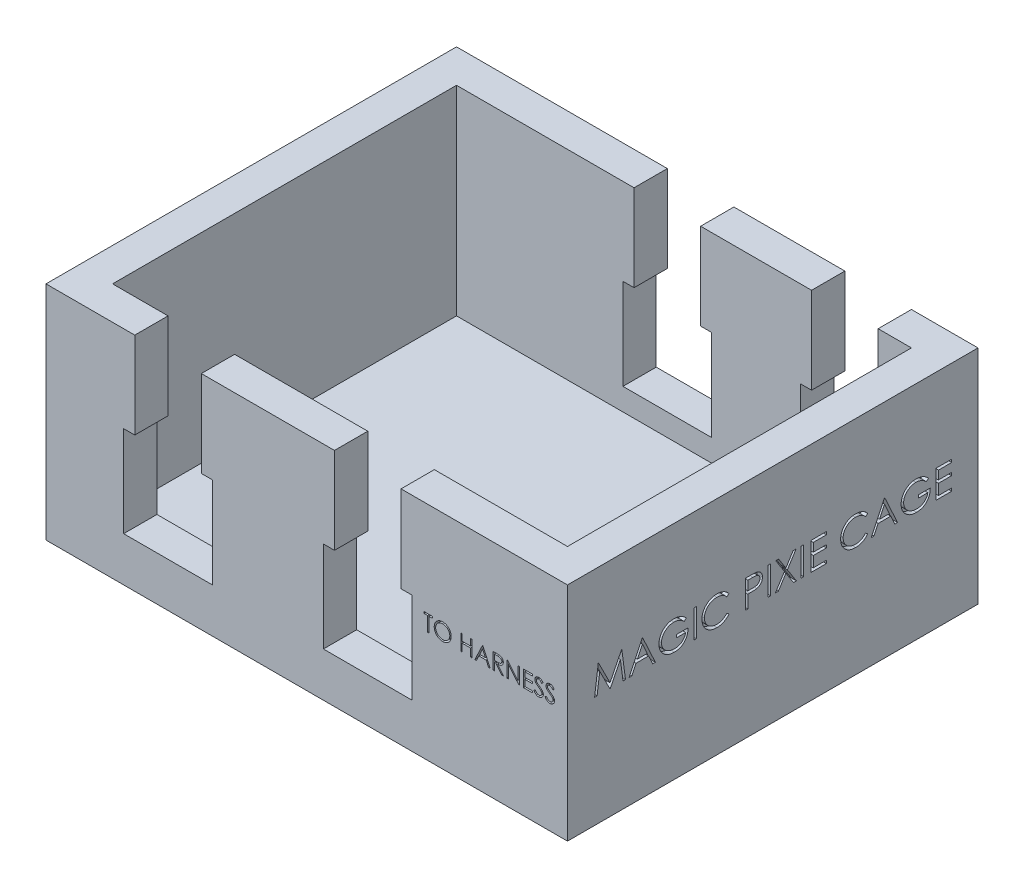
from build123d import *

# Parameters (mm, degrees)
SKETCH2_W           = 59.69
SKETCH2_H           = 46.99
SKETCH2_W_2         = 52.07
SKETCH2_H_2         = 39.37
BOSS_EXTRUDE1_DEPTH = 2.54
SKETCH2_3_W         = 59.69
SKETCH2_3_H         = 46.99
SKETCH2_3_W_2       = 52.07
SKETCH2_3_H_2       = 39.37
BOSS_EXTRUDE2_DEPTH = 25.4
SKETCH3_W           = 7.62
SKETCH3_H           = 9.906
SKETCH3_W_2         = 10.16
SKETCH3_H_2         = 10.414
CUT_EXTRUDE1_DEPTH  = 25.4
SKETCH4_W           = 10.16
SKETCH4_H           = 10.414
SKETCH4_W_2         = 7.62
SKETCH4_H_2         = 9.906
CUT_EXTRUDE2_DEPTH  = 25.4
SKETCH5_W           = 0.237446581
SKETCH5_H           = 2.645833333
CUT_EXTRUDE3_DEPTH  = 0.635
CUT_EXTRUDE4_DEPTH  = 0.635
SKETCH7_W           = 0.284935897
SKETCH7_H           = 3.175
SKETCH7_W_2         = 0.284935898
CUT_EXTRUDE5_DEPTH  = 0.635
SKETCH8_W           = 0.284935898
SKETCH8_H           = 3.175
CUT_EXTRUDE6_DEPTH  = 0.635


with BuildPart() as part:
    # Sketch2 → Boss-Extrude1 (new body)
    # profile 1 of 2: a face of its own
    with BuildSketch(Plane(origin=(0, 0, 0), x_dir=(1, 0, 0), z_dir=(0, 1, 0))):
        Rectangle(SKETCH2_W, SKETCH2_H)
        Rectangle(SKETCH2_W_2, SKETCH2_H_2, mode=Mode.SUBTRACT)
    # profile 2 of 2: a face of its own
    with BuildSketch(Plane(origin=(0, 0, 0), x_dir=(1, 0, 0), z_dir=(0, 1, 0))):
        Rectangle(SKETCH2_W_2, SKETCH2_H_2)
    extrude(amount=BOSS_EXTRUDE1_DEPTH)

    # Sketch2<3> → Boss-Extrude2 (add)
    with BuildSketch(Plane(origin=(0, 0, 0), x_dir=(1, 0, 0), z_dir=(0, 1, 0))):
        Rectangle(SKETCH2_3_W, SKETCH2_3_H)
        Rectangle(SKETCH2_3_W_2, SKETCH2_3_H_2, mode=Mode.SUBTRACT)
    extrude(amount=BOSS_EXTRUDE2_DEPTH)

    # Sketch3 → Cut-Extrude1 (cut)
    with BuildSketch(Plane.XY.offset(23.495)):
        with Locations((-15.875, 20.447)):
            Rectangle(SKETCH3_W, SKETCH3_H)
        with Locations((-15.875, 10.287)):
            Rectangle(SKETCH3_W_2, SKETCH3_H_2)
        with Locations((6.985, 20.447)):
            Rectangle(SKETCH3_W, SKETCH3_H)
        with Locations((6.985, 10.287)):
            Rectangle(SKETCH3_W_2, SKETCH3_H_2)
    extrude(amount=-CUT_EXTRUDE1_DEPTH, mode=Mode.SUBTRACT)

    # Sketch4 → Cut-Extrude2 (cut)
    with BuildSketch(Plane(origin=(0, 0, -23.495), x_dir=(-1, 0, 0), z_dir=(0, 0, -1))):
        with Locations((-18.415, 10.287)):
            Rectangle(SKETCH4_W, SKETCH4_H)
        with Locations((-18.415, 20.447)):
            Rectangle(SKETCH4_W_2, SKETCH4_H_2)
        with Locations((1.905, 20.447)):
            Rectangle(SKETCH4_W_2, SKETCH4_H_2)
        with Locations((1.905, 10.287)):
            Rectangle(SKETCH4_W, SKETCH4_H)
    extrude(amount=-CUT_EXTRUDE2_DEPTH, mode=Mode.SUBTRACT)

    # Sketch5 → Cut-Extrude3 (cut)
    # profile 1 of 10: a face of its own
    with BuildSketch(Plane(origin=(0, 0, -23.495), x_dir=(-1, 0, 0), z_dir=(0, 0, -1))):
        with BuildLine():
            Line((27.132681624, 13.210404147), (27.356347823, 13.344497863))
            add(Edge.make_bspline(
                [(27.356347823, 13.344497863), (27.3771503, 13.309675382), (27.417007043, 13.242956851), (27.483494083, 13.152803451), (27.552386224, 13.076178488), (27.624193637, 13.013527719), (27.698478014, 12.964202668), (27.775724293, 12.929275981), (27.855672162, 12.907492475), (27.910080943, 12.904846577), (27.937243924, 12.903525641)],
                knots=[0, 0, 0, 0, 1.272034388, 2.437168799, 3.508375237, 4.49857839, 5.41946034, 6.295179144, 7.148887113, 8, 8, 8, 8], degree=3))
            add(Edge.make_bspline(
                [(27.937243924, 12.903525641), (27.960441729, 12.904171733), (28.006431432, 12.905452611), (28.074136223, 12.917760122), (28.139890324, 12.936668101), (28.20233852, 12.963747019), (28.260619133, 12.996508851), (28.311726576, 13.036080068), (28.355909054, 13.080383569), (28.392050468, 13.129809742), (28.419778828, 13.182966158), (28.441090689, 13.23752774), (28.45291762, 13.294351599), (28.454699213, 13.332610698), (28.455598291, 13.351918069)],
                knots=[0, 0, 0, 0, 1.095163259, 2.171163733, 3.241058638, 4.321873601, 5.38011039, 6.391990106, 7.366004449, 8.327778327, 9.272591725, 10.192022065, 11.087607919, 12, 12, 12, 12], degree=3))
            add(Edge.make_bspline(
                [(28.455598291, 13.351918069), (28.454483782, 13.373947164), (28.452218149, 13.418729094), (28.433068756, 13.48479907), (28.402944623, 13.550183334), (28.375153815, 13.590627743), (28.360725661, 13.611625267)],
                knots=[0, 0, 0, 0, 0.938893495, 1.908633276, 2.914225137, 4, 4, 4, 4], degree=3))
            add(Edge.make_bspline(
                [(28.360725661, 13.611625267), (28.348879423, 13.626779711), (28.324009728, 13.658594571), (28.281254942, 13.705951386), (28.231085319, 13.754799833), (28.175217751, 13.807005192), (28.111617142, 13.860139419), (28.042275509, 13.916736272), (27.965422473, 13.974643417), (27.911523449, 14.01347863), (27.88371244, 14.03351696)],
                knots=[0, 0, 0, 0, 0.722233717, 1.516239348, 2.393582979, 3.351407094, 4.387010283, 5.505090956, 6.712668013, 8, 8, 8, 8], degree=3))
            add(Edge.make_bspline(
                [(27.88371244, 14.03351696), (27.855875252, 14.053344524), (27.802652669, 14.091253315), (27.72822267, 14.14751453), (27.661665248, 14.198952455), (27.60327623, 14.246051321), (27.553081296, 14.288817516), (27.510684908, 14.326840363), (27.477167071, 14.361148174), (27.458528626, 14.383404426), (27.450160423, 14.393396935)],
                knots=[0, 0, 0, 0, 1.452282411, 2.77665338, 3.964542531, 5.026858415, 5.96415736, 6.766646006, 7.446254459, 8, 8, 8, 8], degree=3))
            add(Edge.make_bspline(
                [(27.450160423, 14.393396935), (27.438463916, 14.408970338), (27.415461164, 14.439597525), (27.385097577, 14.487468102), (27.359289996, 14.536471404), (27.339058947, 14.586739111), (27.322022639, 14.637565515), (27.310563965, 14.689613778), (27.303388921, 14.742650353), (27.302654145, 14.778341511), (27.302286325, 14.7962081)],
                knots=[0, 0, 0, 0, 1.068054152, 2.10047183, 3.106115577, 4.101338837, 5.06977816, 6.043150881, 7.020423561, 8, 8, 8, 8], degree=3))
            add(Edge.make_bspline(
                [(27.302286325, 14.7962081), (27.303273001, 14.824200846), (27.305225263, 14.879588013), (27.321735654, 14.960498224), (27.34779552, 15.03774629), (27.384304155, 15.110567435), (27.43136775, 15.177065527), (27.485831075, 15.238005485), (27.550700473, 15.289235306), (27.621875372, 15.333996802), (27.699781082, 15.369032115), (27.781417063, 15.395460951), (27.866913064, 15.410435807), (27.924821386, 15.412584802), (27.954204394, 15.413675214)],
                knots=[0, 0, 0, 0, 1.005424448, 1.989358655, 2.955360095, 3.929531133, 4.905563448, 5.876582895, 6.856512386, 7.866279853, 8.892233794, 9.918561126, 10.94386622, 12, 12, 12, 12], degree=3))
            add(Edge.make_bspline(
                [(27.954204394, 15.413675214), (27.98538297, 15.412599832), (28.047387206, 15.410461242), (28.138592267, 15.39186668), (28.226404238, 15.36109891), (28.297042896, 15.326182484), (28.352327781, 15.291309331), (28.394489311, 15.259544344), (28.437213813, 15.222975066), (28.480845914, 15.181504088), (28.524646293, 15.134750889), (28.569265212, 15.083035666), (28.614807011, 15.02667446), (28.644104596, 14.986439272), (28.659123932, 14.9658128)],
                knots=[0, 0, 0, 0, 1.286793592, 2.559021753, 3.825965368, 5.121522368, 5.803751409, 6.523245864, 7.299691795, 8.125521123, 9.008227632, 9.944561021, 10.946284179, 12, 12, 12, 12], degree=3))
            Line((28.659123932, 14.9658128), (28.444467982, 14.803098291))
            add(Edge.make_bspline(
                [(28.444467982, 14.803098291), (28.431506474, 14.819796289), (28.406545639, 14.851952729), (28.368650134, 14.896985807), (28.332932406, 14.938122074), (28.29774252, 14.97385226), (28.264939001, 15.00613304), (28.233100523, 15.033770475), (28.202685269, 15.057035359), (28.1643457, 15.081863527), (28.116178139, 15.106474693), (28.055713639, 15.127300484), (27.992526395, 15.139815323), (27.949490304, 15.141470018), (27.927703659, 15.142307692)],
                knots=[0, 0, 0, 0, 1.181633172, 2.275549214, 3.290209073, 4.226197932, 5.078386478, 5.862611352, 6.581680152, 7.217281963, 8.414376989, 9.595101626, 10.782541182, 12, 12, 12, 12], degree=3))
            add(Edge.make_bspline(
                [(27.927703659, 15.142307692), (27.90037105, 15.141391705), (27.847662688, 15.139625309), (27.772830783, 15.120333416), (27.705480018, 15.089957843), (27.647609925, 15.047386401), (27.599427805, 14.996948508), (27.564574274, 14.938907349), (27.543596471, 14.87481589), (27.541036605, 14.830107614), (27.539732906, 14.807338408)],
                knots=[0, 0, 0, 0, 1.14458467, 2.207223713, 3.21896685, 4.227309161, 5.202851033, 6.127160689, 7.046193047, 8, 8, 8, 8], degree=3))
            add(Edge.make_bspline(
                [(27.539732906, 14.807338408), (27.540030091, 14.793163183), (27.540624947, 14.764789554), (27.548921371, 14.72287092), (27.559579793, 14.681058181), (27.576469758, 14.639539324), (27.599787339, 14.597588231), (27.630407323, 14.554482513), (27.668970958, 14.509842233), (27.698511319, 14.480808087), (27.714107739, 14.465478933)],
                knots=[0, 0, 0, 0, 0.858281714, 1.717966888, 2.583508476, 3.4729293, 4.427298488, 5.488583878, 6.674047936, 8, 8, 8, 8], degree=3))
            add(Edge.make_bspline(
                [(27.714107739, 14.465478933), (27.719899372, 14.460310467), (27.733658965, 14.448031375), (27.758813981, 14.427928877), (27.792032644, 14.403131543), (27.832447522, 14.372449465), (27.880803801, 14.336858121), (27.937106799, 14.296812593), (28.00072891, 14.251012871), (28.045875835, 14.218992588), (28.069747596, 14.202061632)],
                knots=[0, 0, 0, 0, 0.420754252, 0.999615792, 1.744751191, 2.668019286, 3.750313428, 4.999500688, 6.413464383, 8, 8, 8, 8], degree=3))
            add(Edge.make_bspline(
                [(28.069747596, 14.202061632), (28.098463138, 14.18116608), (28.154066804, 14.140704741), (28.233182951, 14.079914316), (28.304918151, 14.020460348), (28.369524263, 13.962722514), (28.427639545, 13.907138777), (28.478619251, 13.853040421), (28.522982831, 13.800815018), (28.570743311, 13.733858368), (28.619545949, 13.651625048), (28.661457088, 13.550873047), (28.687883934, 13.4497294), (28.691339782, 13.381748993), (28.693044872, 13.348207966)],
                knots=[0, 0, 0, 0, 1.163667725, 2.253281268, 3.268753668, 4.215851969, 5.092017293, 5.902905408, 6.650798638, 7.335211899, 8.59617414, 9.77448103, 10.901945474, 12, 12, 12, 12], degree=3))
            add(Edge.make_bspline(
                [(28.693044872, 13.348207966), (28.692548107, 13.324487416), (28.691564223, 13.277506954), (28.680254485, 13.208522461), (28.663684262, 13.141521744), (28.638709686, 13.077332986), (28.608227299, 13.014781886), (28.569548052, 12.955509247), (28.524714266, 12.89820322), (28.47328398, 12.84439189), (28.417006423, 12.794993277), (28.357525296, 12.751050475), (28.294743245, 12.714410731), (28.229000851, 12.684512177), (28.160283013, 12.661127911), (28.088612843, 12.644184849), (28.0138722, 12.633786187), (27.963071836, 12.632706867), (27.937243924, 12.63215812)],
                knots=[0, 0, 0, 0, 0.983748083, 1.948392443, 2.894712957, 3.844097841, 4.80183111, 5.778335162, 6.776009319, 7.81870978, 8.863265674, 9.881300176, 10.883814829, 11.87499822, 12.874611388, 13.892143829, 14.928324115, 16, 16, 16, 16], degree=3))
            add(Edge.make_bspline(
                [(27.937243924, 12.63215812), (27.917260063, 12.632544549), (27.877544018, 12.63331254), (27.81879935, 12.64010196), (27.761241447, 12.649707925), (27.705592555, 12.664958562), (27.651135702, 12.683461991), (27.598107733, 12.706245135), (27.546482948, 12.733548019), (27.495972038, 12.764765092), (27.446703465, 12.801094458), (27.399139344, 12.843407756), (27.351719066, 12.890537989), (27.305842285, 12.943765022), (27.260581039, 13.00222893), (27.216827717, 13.066476705), (27.173676657, 13.136158395), (27.146601869, 13.185193311), (27.132681624, 13.210404147)],
                knots=[0, 0, 0, 0, 0.915332311, 1.819136955, 2.706846663, 3.586547465, 4.459518054, 5.340707479, 6.227863349, 7.133153174, 8.059268498, 9.028702269, 10.047606654, 11.120612155, 12.245963614, 13.433783089, 14.680604001, 16, 16, 16, 16], degree=3))
        make_face()
    # profile 2 of 10: a face of its own
    with BuildSketch(Plane(origin=(0, 0, -23.495), x_dir=(-1, 0, 0), z_dir=(0, 0, -1))):
        with BuildLine():
            Line((25.165267094, 15.345833333), (25.694751769, 15.345833333))
            add(Edge.make_bspline(
                [(25.694751769, 15.345833333), (25.730085837, 15.345715718), (25.79793116, 15.345489883), (25.89512643, 15.344230645), (25.983442152, 15.34062146), (26.06283215, 15.337515566), (26.133294966, 15.331852015), (26.195046668, 15.326438907), (26.247802844, 15.319352866), (26.279738696, 15.312771981), (26.294198384, 15.309792334)],
                knots=[0, 0, 0, 0, 1.410062039, 2.707475311, 3.878576406, 4.937260626, 5.877586885, 6.699081471, 7.410979367, 8, 8, 8, 8], degree=3))
            add(Edge.make_bspline(
                [(26.294198384, 15.309792334), (26.313555773, 15.305009601), (26.351857604, 15.295546163), (26.40700438, 15.275543965), (26.459553899, 15.252396987), (26.509287873, 15.225210127), (26.555957191, 15.193781573), (26.600043057, 15.158653885), (26.641745521, 15.120019271), (26.679378063, 15.076903647), (26.71486175, 15.031670095), (26.744788867, 14.982757136), (26.77058686, 14.931608243), (26.791126478, 14.877703231), (26.807665184, 14.821564868), (26.819326686, 14.762684646), (26.826320143, 14.701330814), (26.827032141, 14.659482871), (26.827393162, 14.638263722)],
                knots=[0, 0, 0, 0, 1.027469482, 2.033020251, 3.019912614, 3.986113645, 4.951240523, 5.91722682, 6.890402269, 7.87763091, 8.8651537, 9.85103654, 10.82876324, 11.815024772, 12.821070561, 13.842952187, 14.906261191, 16, 16, 16, 16], degree=3))
            add(Edge.make_bspline(
                [(26.827393162, 14.638263722), (26.82628267, 14.603009804), (26.824115811, 14.534220278), (26.803912905, 14.43438854), (26.770819941, 14.341263284), (26.725218407, 14.254961766), (26.667146541, 14.177166219), (26.597353396, 14.108835339), (26.515800035, 14.051655167), (26.439880254, 14.012003345), (26.372816544, 13.986608705), (26.317606837, 13.968740744), (26.257382396, 13.954935567), (26.192720244, 13.942568087), (26.12335129, 13.933230794), (26.049441796, 13.926391999), (25.97093905, 13.922117808), (25.917010111, 13.921481292), (25.889267161, 13.921153846)],
                knots=[0, 0, 0, 0, 1.260483769, 2.459530307, 3.627416485, 4.787058657, 5.939039949, 7.08810263, 8.267026773, 9.491475466, 10.141966685, 10.831826277, 11.566392101, 12.351337768, 13.187381173, 14.07005841, 15.007169909, 16, 16, 16, 16], degree=3))
            Line((25.889267161, 13.921153846), (26.861314103, 12.7))
            Line((26.861314103, 12.7), (26.567685964, 12.7))
            Line((26.567685964, 12.7), (25.595639022, 13.921153846))
            Line((25.595639022, 13.921153846), (25.402713675, 13.921153846))
            Line((25.402713675, 13.921153846), (25.402713675, 12.7))
            Line((25.402713675, 12.7), (25.165267094, 12.7))
            Line((25.165267094, 12.7), (25.165267094, 15.345833333))
        make_face()
        with BuildLine():
            Line((25.402713675, 15.074465812), (25.402713675, 14.192521368))
            Line((25.402713675, 14.192521368), (25.887147102, 14.188811265))
            add(Edge.make_bspline(
                [(25.887147102, 14.188811265), (25.909765227, 14.188801258), (25.953605594, 14.188781863), (26.017030502, 14.191800968), (26.076085586, 14.1952355), (26.130544964, 14.200488875), (26.180432965, 14.207259238), (26.225724652, 14.215728161), (26.266493959, 14.225594899), (26.314042259, 14.240866366), (26.367137732, 14.265061392), (26.424840681, 14.300262691), (26.473979353, 14.344538156), (26.515494642, 14.3951669), (26.54885439, 14.450832398), (26.572373622, 14.510867391), (26.587297968, 14.573756277), (26.589058238, 14.616980204), (26.589946581, 14.638793737)],
                knots=[0, 0, 0, 0, 1.146690395, 2.22261258, 3.21895312, 4.145990853, 4.996080663, 5.770904154, 6.481378293, 7.121626537, 8.300444488, 9.431385265, 10.535395872, 11.636531494, 12.74115979, 13.810798291, 14.895190096, 16, 16, 16, 16], degree=3))
            add(Edge.make_bspline(
                [(26.589946581, 14.638793737), (26.589037835, 14.660071206), (26.587237031, 14.702235387), (26.572534688, 14.763963366), (26.547671882, 14.822222311), (26.514166381, 14.876775225), (26.473345591, 14.926294442), (26.42548034, 14.968663421), (26.371879389, 15.003625814), (26.321781519, 15.025967518), (26.277003275, 15.039665264), (26.238124901, 15.049304537), (26.194195391, 15.057048868), (26.145001443, 15.063253771), (26.090753067, 15.068586973), (26.031175968, 15.072179091), (25.966665426, 15.074306238), (25.921953162, 15.074411383), (25.898807425, 15.074465812)],
                knots=[0, 0, 0, 0, 1.101028733, 2.181837193, 3.264309656, 4.369019818, 5.486613113, 6.575447106, 7.666700264, 8.788928104, 9.402425223, 10.0903467, 10.862060571, 11.710948788, 12.657782767, 13.684531032, 14.801375019, 16, 16, 16, 16], degree=3))
            Line((25.898807425, 15.074465812), (25.402713675, 15.074465812))
        make_face(mode=Mode.SUBTRACT)
    # profile 3 of 10: a face of its own
    with BuildSketch(Plane(origin=(0, 0, -23.495), x_dir=(-1, 0, 0), z_dir=(0, 0, -1))):
        Polygon((23.197852564, 15.345833333), (24.690373932, 15.345833333), (24.690373932, 15.074465812), (23.435299145, 15.074465812), (23.435299145, 14.260363248), (24.690373932, 14.260363248), (24.690373932, 13.988995726), (23.435299145, 13.988995726), (23.435299145, 12.971367521), (24.690373932, 12.971367521), (24.690373932, 12.7), (23.197852564, 12.7), align=None)
    # profile 4 of 10: a face of its own
    with BuildSketch(Plane(origin=(0, 0, -23.495), x_dir=(-1, 0, 0), z_dir=(0, 0, -1))):
        Polygon((21.400042735, 15.074465812), (21.400042735, 15.345833333), (22.790801282, 15.345833333), (22.790801282, 15.074465812), (22.214145299, 15.074465812), (22.214145299, 12.7), (21.976698718, 12.7), (21.976698718, 15.074465812), align=None)
    # profile 5 of 10: a face of its own
    with BuildSketch(Plane(origin=(0, 0, -23.495), x_dir=(-1, 0, 0), z_dir=(0, 0, -1))):
        with Locations((20.908189102, 14.022916667)):
            Rectangle(SKETCH5_W, SKETCH5_H)
    # profile 6 of 10: a face of its own
    with BuildSketch(Plane(origin=(0, 0, -23.495), x_dir=(-1, 0, 0), z_dir=(0, 0, -1))):
        Polygon((18.075790598, 12.7), (18.075790598, 15.345833333), (18.125611979, 15.345833333), (19.873600427, 13.263405616), (19.873600427, 15.345833333), (20.111047009, 15.345833333), (20.111047009, 12.7), (20.05698551, 12.7), (18.313237179, 14.777657585), (18.313237179, 12.7), align=None)
    # profile 7 of 10: a face of its own
    with BuildSketch(Plane(origin=(0, 0, -23.495), x_dir=(-1, 0, 0), z_dir=(0, 0, -1))):
        with BuildLine():
            Line((17.363450855, 14.894260817), (17.159925214, 14.70133547))
            add(Edge.make_bspline(
                [(17.159925214, 14.70133547), (17.123096054, 14.73598142), (17.050315948, 14.804447168), (16.931661478, 14.893279884), (16.807863969, 14.969378662), (16.679569403, 15.031295877), (16.549954901, 15.080699452), (16.420740886, 15.11587251), (16.293252766, 15.138303535), (16.208459691, 15.140985934), (16.166677684, 15.142307692)],
                knots=[0, 0, 0, 0, 1.08915593, 2.152340314, 3.188132944, 4.216796309, 5.218260357, 6.173443236, 7.099959455, 8, 8, 8, 8], degree=3))
            add(Edge.make_bspline(
                [(16.166677684, 15.142307692), (16.141039786, 15.141995026), (16.089830483, 15.141370504), (16.013765085, 15.13339958), (15.938497448, 15.121935664), (15.864169659, 15.10534865), (15.790637199, 15.084326325), (15.71815581, 15.058030171), (15.646590286, 15.027372338), (15.576614736, 14.991946539), (15.508775189, 14.953030227), (15.444703057, 14.909904247), (15.383989952, 14.863950816), (15.327777012, 14.814019421), (15.275740888, 14.76056235), (15.226643012, 14.704574018), (15.182210175, 14.644524775), (15.142075783, 14.581519451), (15.106272654, 14.516664641), (15.074667303, 14.450584583), (15.048135576, 14.383498455), (15.02714319, 14.315322075), (15.009823827, 14.246582879), (14.997639683, 14.176804906), (14.990770554, 14.105913441), (14.989582363, 14.058441704), (14.988985043, 14.03457699)],
                knots=[0, 0, 0, 0, 1.02818874, 2.053710826, 3.065248034, 4.081641283, 5.106893873, 6.131558223, 7.173050175, 8.228653731, 9.27666206, 10.308777013, 11.325269123, 12.329503258, 13.32196095, 14.316845687, 15.314881793, 16.315733098, 17.311955233, 18.285320748, 19.252783886, 20.203351036, 21.145449891, 22.095197417, 23.042428769, 24, 24, 24, 24], degree=3))
            add(Edge.make_bspline(
                [(14.988985043, 14.03457699), (14.98955633, 14.010181789), (14.990697344, 13.961458002), (14.998000085, 13.888739863), (15.011552981, 13.817101732), (15.029671428, 13.746308203), (15.052335497, 13.676238033), (15.080587453, 13.607195005), (15.114050139, 13.539181673), (15.152782533, 13.472810856), (15.195256627, 13.408159523), (15.242838599, 13.34726036), (15.293382016, 13.289302416), (15.348728238, 13.235572523), (15.407102535, 13.184633506), (15.470248958, 13.137888796), (15.536925818, 13.094437996), (15.607234841, 13.054828723), (15.680413135, 13.019443699), (15.755446514, 12.987978015), (15.832574684, 12.962064469), (15.911392312, 12.940944592), (15.99180544, 12.923633058), (16.074222243, 12.912496005), (16.158036731, 12.904414246), (16.214535578, 12.90382334), (16.2429998, 12.903525641)],
                knots=[0, 0, 0, 0, 0.93586088, 1.869166235, 2.799637598, 3.729985548, 4.670839027, 5.622275134, 6.589130586, 7.576015415, 8.568469353, 9.55398029, 10.53834874, 11.515998671, 12.510579167, 13.508179873, 14.527009472, 15.561807829, 16.601455013, 17.643573243, 18.680854198, 19.719860599, 20.772568776, 21.833555941, 22.908541556, 24, 24, 24, 24], degree=3))
            add(Edge.make_bspline(
                [(16.2429998, 12.903525641), (16.277303669, 12.90424272), (16.344664891, 12.90565082), (16.443684404, 12.916612348), (16.538785535, 12.933732246), (16.629701057, 12.958804084), (16.716536567, 12.990783648), (16.799610398, 13.029333732), (16.878268497, 13.075932949), (16.952747324, 13.12852748), (17.021355435, 13.187125002), (17.083233255, 13.250356227), (17.137393833, 13.31791423), (17.184644409, 13.389401105), (17.22373369, 13.465408568), (17.255818422, 13.545564136), (17.280412041, 13.629903862), (17.290507766, 13.688181464), (17.295608974, 13.717628205)],
                knots=[0, 0, 0, 0, 1.13008108, 2.219097802, 3.278683437, 4.311054135, 5.322181354, 6.324827112, 7.324222904, 8.330512327, 9.32562643, 10.293043162, 11.24128371, 12.174520618, 13.111833804, 14.052305215, 15.015860969, 16, 16, 16, 16], degree=3))
            Line((17.295608974, 13.717628205), (16.41366453, 13.717628205))
            Line((16.41366453, 13.717628205), (16.41366453, 13.988995726))
            Line((16.41366453, 13.988995726), (17.533055556, 13.988995726))
            add(Edge.make_bspline(
                [(17.533055556, 13.988995726), (17.531766015, 13.938416851), (17.529242152, 13.839424855), (17.511538567, 13.695060424), (17.482951085, 13.558708013), (17.443898349, 13.430224025), (17.393343822, 13.309790535), (17.331830065, 13.197285267), (17.258372569, 13.093435038), (17.17558789, 12.997392041), (17.082681374, 12.911720553), (16.982163429, 12.836423207), (16.873867983, 12.772996826), (16.757897474, 12.721395015), (16.634631551, 12.681122412), (16.503784978, 12.652568899), (16.365535197, 12.635461724), (16.270786637, 12.633275979), (16.222329227, 12.63215812)],
                knots=[0, 0, 0, 0, 1.140356446, 2.231883559, 3.274166699, 4.278491846, 5.25512956, 6.21435461, 7.1637429, 8.11826594, 9.068280886, 10.0076534, 10.945064095, 11.891975133, 12.864533718, 13.863980011, 14.907571808, 16, 16, 16, 16], degree=3))
            add(Edge.make_bspline(
                [(16.222329227, 12.63215812), (16.192461446, 12.632588348), (16.133552556, 12.633436898), (16.046549295, 12.639467392), (15.961944903, 12.648750923), (15.879751706, 12.662770153), (15.799667364, 12.67994135), (15.722091844, 12.701929525), (15.646729634, 12.727381458), (15.573464252, 12.756331164), (15.502960696, 12.789874023), (15.434904936, 12.827149763), (15.368920782, 12.867966172), (15.305457699, 12.913029133), (15.244185021, 12.962001588), (15.185497834, 13.014981693), (15.129067593, 13.07180748), (15.093718909, 13.11215947), (15.075907452, 13.132491987)],
                knots=[0, 0, 0, 0, 1.107784379, 2.184907829, 3.233506516, 4.263428166, 5.276301166, 6.270063455, 7.25232949, 8.225834625, 9.190232166, 10.146266622, 11.1027726, 12.066435141, 13.031522626, 14.010570082, 14.99756817, 16, 16, 16, 16], degree=3))
            add(Edge.make_bspline(
                [(15.075907452, 13.132491987), (15.050064515, 13.164748969), (14.998807608, 13.2287275), (14.932829478, 13.331234601), (14.87658556, 13.437371721), (14.830950361, 13.547434327), (14.795316213, 13.66131947), (14.769760295, 13.778881625), (14.754786928, 13.900272179), (14.75262979, 13.982417944), (14.751538462, 14.023976696)],
                knots=[0, 0, 0, 0, 1.023165419, 2.029347347, 3.013907458, 3.994755782, 4.975994455, 5.96558838, 6.970761222, 8, 8, 8, 8], degree=3))
            add(Edge.make_bspline(
                [(14.751538462, 14.023976696), (14.751940808, 14.055096423), (14.752740388, 14.116940364), (14.762435868, 14.208756304), (14.776346463, 14.298941947), (14.796792749, 14.387423569), (14.822567901, 14.474260267), (14.85473631, 14.559492359), (14.892189892, 14.643170142), (14.935721785, 14.72471765), (14.984166585, 14.803052771), (15.036743239, 14.877860158), (15.094198342, 14.947777487), (15.155593619, 15.013690221), (15.221661582, 15.074770302), (15.291783289, 15.131583231), (15.36601278, 15.184205217), (15.444583583, 15.231807413), (15.526322964, 15.274566817), (15.611034989, 15.3120539), (15.698693799, 15.343035334), (15.788642666, 15.369322656), (15.881562443, 15.388762078), (15.976778831, 15.402859641), (16.074788142, 15.412506047), (16.141036807, 15.413281847), (16.174627905, 15.413675214)],
                knots=[0, 0, 0, 0, 1.008945113, 2.00506715, 2.99143336, 3.967273523, 4.948097931, 5.927297278, 6.919902385, 7.919676788, 8.923139349, 9.905703106, 10.883022732, 11.856032218, 12.825136022, 13.798837087, 14.781400844, 15.773989409, 16.776158564, 17.77167057, 18.775803737, 19.789618931, 20.80898985, 21.851988756, 22.910860228, 24, 24, 24, 24], degree=3))
            add(Edge.make_bspline(
                [(16.174627905, 15.413675214), (16.202022291, 15.413237146), (16.256342141, 15.412368508), (16.337172903, 15.406347613), (16.416754289, 15.39680456), (16.495204298, 15.38378193), (16.572255777, 15.366044497), (16.648128227, 15.344818651), (16.722931632, 15.32010519), (16.796431559, 15.290631479), (16.869122213, 15.257177846), (16.941407771, 15.21952127), (17.013041249, 15.177017844), (17.084146871, 15.129541362), (17.155173026, 15.077907231), (17.224996297, 15.020638679), (17.295302094, 14.959994096), (17.340509418, 14.916389112), (17.363450855, 14.894260817)],
                knots=[0, 0, 0, 0, 0.985871117, 1.954866573, 2.915460327, 3.869826059, 4.81536089, 5.759505086, 6.70452669, 7.649098992, 8.607881297, 9.583363685, 10.581137262, 11.603961102, 12.659522466, 13.73993555, 14.853081303, 16, 16, 16, 16], degree=3))
        make_face()
    # profile 8 of 10: a face of its own
    with BuildSketch(Plane(origin=(0, 0, -23.495), x_dir=(-1, 0, 0), z_dir=(0, 0, -1))):
        with Locations((14.090080129, 14.022916667)):
            Rectangle(SKETCH5_W, SKETCH5_H)
    # profile 9 of 10: a face of its own
    with BuildSketch(Plane(origin=(0, 0, -23.495), x_dir=(-1, 0, 0), z_dir=(0, 0, -1))):
        with BuildLine():
            add(Edge.make_bspline(
                [(11.003274573, 15.413675214), (11.052266415, 15.412434333), (11.148490434, 15.409997142), (11.289910149, 15.391340915), (11.424919536, 15.359065233), (11.554618391, 15.316079526), (11.677455344, 15.258737223), (11.794354983, 15.189427617), (11.905039167, 15.10742458), (12.008016045, 15.013362009), (12.102250763, 14.911018565), (12.185273903, 14.801800145), (12.254853494, 14.686367122), (12.31199275, 14.565066375), (12.356819675, 14.438172232), (12.387752524, 14.305008195), (12.407511721, 14.166437066), (12.409821743, 14.07192271), (12.41099359, 14.023976696)],
                knots=[0, 0, 0, 0, 1.065120563, 2.091984664, 3.0946048, 4.079830382, 5.057816894, 6.036188127, 7.030412546, 8.04752943, 9.064399622, 10.05169764, 11.02544977, 11.989514704, 12.962713494, 13.945757189, 14.957906945, 16, 16, 16, 16], degree=3))
            add(Edge.make_bspline(
                [(12.41099359, 14.023976696), (12.409821915, 13.976383865), (12.407512407, 13.88257288), (12.387730057, 13.74488111), (12.356705016, 13.612520881), (12.312409029, 13.485713155), (12.255542149, 13.364324164), (12.185499252, 13.248673312), (12.102993694, 13.138722685), (12.009099229, 13.035676801), (11.906742489, 12.941184665), (11.796955323, 12.858847182), (11.682206801, 12.787996207), (11.561020296, 12.73146331), (11.435003006, 12.686278585), (11.303027083, 12.655471537), (11.165710938, 12.635599784), (11.072070358, 12.63331793), (11.02447516, 12.63215812)],
                knots=[0, 0, 0, 0, 1.043624062, 2.057103931, 3.04512605, 4.022047818, 4.998200453, 5.980619268, 6.982898556, 8.009068085, 9.034988726, 10.034168286, 11.015286542, 11.987931943, 12.962482838, 13.94673481, 14.956375938, 16, 16, 16, 16], degree=3))
            add(Edge.make_bspline(
                [(11.02447516, 12.63215812), (10.976529395, 12.633329382), (10.88201553, 12.635638253), (10.743270271, 12.655430148), (10.610012691, 12.686379824), (10.482623866, 12.730610172), (10.361032758, 12.787773197), (10.245001565, 12.857475317), (10.134996019, 12.940181906), (10.031928151, 13.034045924), (9.937623698, 13.136229181), (9.855406789, 13.24571698), (9.785688995, 13.360361284), (9.728717904, 13.480480246), (9.683614414, 13.605493182), (9.65284351, 13.736233995), (9.632934784, 13.871957312), (9.630640585, 13.964367122), (9.629476496, 14.011256343)],
                knots=[0, 0, 0, 0, 1.053102029, 2.075944431, 3.073151272, 4.055350789, 5.033113405, 6.020478099, 7.024410459, 8.052272461, 9.079885166, 10.07527673, 11.055994387, 12.023226415, 12.992069828, 13.970394897, 14.97016774, 16, 16, 16, 16], degree=3))
            add(Edge.make_bspline(
                [(9.629476496, 14.011256343), (9.629880655, 14.042728659), (9.630683874, 14.105276252), (9.640353784, 14.198157551), (9.654385547, 14.289545132), (9.674495326, 14.379179122), (9.700796169, 14.466840105), (9.731829547, 14.553132646), (9.769732883, 14.637182246), (9.812580753, 14.719387072), (9.860403668, 14.798465668), (9.913226407, 14.873213924), (9.96919362, 14.944259082), (10.030549281, 15.009760091), (10.095271236, 15.071622438), (10.164409415, 15.128895445), (10.237541945, 15.182095557), (10.314983506, 15.230038314), (10.394825892, 15.273399089), (10.477131552, 15.310608464), (10.56078265, 15.342544475), (10.646170985, 15.368428908), (10.733069807, 15.38886384), (10.821668775, 15.402778923), (10.911897306, 15.412473497), (10.972684434, 15.413272918), (11.003274573, 15.413675214)],
                knots=[0, 0, 0, 0, 1.037015668, 2.060948919, 3.074880161, 4.083647147, 5.086022904, 6.090072063, 7.104153813, 8.122640571, 9.144368836, 10.147691507, 11.138137339, 12.123020368, 13.103399296, 14.087645067, 15.080126199, 16.082011238, 17.087798457, 18.072939717, 19.057185487, 20.037253025, 21.01195951, 21.997135196, 22.992090687, 24, 24, 24, 24], degree=3))
        make_face()
        with BuildLine():
            add(Edge.make_bspline(
                [(11.014934896, 15.142307692), (10.989826215, 15.142001615), (10.939848893, 15.141392385), (10.865550463, 15.13336741), (10.79222918, 15.121929934), (10.7198699, 15.105615332), (10.648775384, 15.083387268), (10.578282945, 15.057805153), (10.509035398, 15.026643972), (10.441261351, 14.991437225), (10.375557693, 14.952468696), (10.313559996, 14.909400753), (10.255107759, 14.863243393), (10.200344099, 14.813888897), (10.14942982, 14.761085924), (10.101362813, 14.705634976), (10.058069737, 14.645951106), (10.01839314, 14.583652762), (9.982887689, 14.518821091), (9.95131507, 14.452138635), (9.925488706, 14.383061455), (9.904426077, 14.312338967), (9.88696372, 14.240083179), (9.87590117, 14.16574596), (9.867788017, 14.089700846), (9.86721361, 14.038309801), (9.866923077, 14.012316373)],
                knots=[0, 0, 0, 0, 1.008559885, 2.007477868, 2.99961109, 3.989939068, 4.984837346, 5.991145699, 7.001802488, 8.033829008, 9.059044045, 10.069351652, 11.065060232, 12.050310815, 13.029377138, 14.011219647, 14.996725999, 15.989392538, 16.977580475, 17.965360261, 18.951710183, 19.937753436, 20.929683414, 21.935841486, 22.955955122, 24, 24, 24, 24], degree=3))
            add(Edge.make_bspline(
                [(9.866923077, 14.012316373), (9.867886812, 13.974093742), (9.869782777, 13.898898002), (9.886381654, 13.788704226), (9.911949456, 13.682804152), (9.949639251, 13.581777233), (9.996773347, 13.484755067), (10.055002008, 13.392598345), (10.123989531, 13.30528216), (10.20235422, 13.223416094), (10.28802079, 13.148693372), (10.378986604, 13.083104367), (10.474277129, 13.027609714), (10.574140859, 12.982399927), (10.678044654, 12.946575542), (10.786658041, 12.922023244), (10.899257495, 12.905864417), (10.976009836, 12.904312631), (11.014934896, 12.903525641)],
                knots=[0, 0, 0, 0, 1.032063989, 2.030389145, 3.003944642, 3.970395727, 4.937377036, 5.913328081, 6.909231446, 7.93887556, 8.970685674, 9.976071282, 10.964166581, 11.944589148, 12.933237628, 13.927779006, 14.949070134, 16, 16, 16, 16], degree=3))
            add(Edge.make_bspline(
                [(11.014934896, 12.903525641), (11.041098031, 12.9038851), (11.092987386, 12.904598014), (11.170166739, 12.911778562), (11.245955661, 12.923293129), (11.320247849, 12.939871661), (11.392958986, 12.960620442), (11.464392557, 12.985270331), (11.533787694, 13.016023384), (11.602019833, 13.050001895), (11.667331277, 13.088737014), (11.729678852, 13.130343235), (11.787491051, 13.176432609), (11.842213742, 13.225053812), (11.893337055, 13.277187197), (11.940515275, 13.332764984), (11.983589542, 13.392137981), (12.023251072, 13.454341829), (12.05863211, 13.519350901), (12.089459167, 13.586275122), (12.115612183, 13.654949699), (12.136724803, 13.725473684), (12.15326917, 13.797713135), (12.164668871, 13.871764778), (12.172642988, 13.947480471), (12.173244029, 13.9986916), (12.173547009, 14.024506711)],
                knots=[0, 0, 0, 0, 1.047197238, 2.076906641, 3.100256066, 4.114471768, 5.12198147, 6.126382909, 7.136867548, 8.15857795, 9.17633901, 10.174870724, 11.156907918, 12.133735059, 13.104061851, 14.077631395, 15.04955518, 16.038496417, 17.029181396, 18.010275684, 18.986308667, 19.968651475, 20.955262928, 21.950658345, 22.966943676, 24, 24, 24, 24], degree=3))
            add(Edge.make_bspline(
                [(12.173547009, 14.024506711), (12.173243786, 14.050145217), (12.172642289, 14.101003917), (12.16467268, 14.176191559), (12.153257126, 14.249710356), (12.136805555, 14.321271683), (12.115600975, 14.390893783), (12.0894546, 14.458511264), (12.058622856, 14.524376031), (12.023238067, 14.588325291), (11.98346301, 14.649689528), (11.9400001, 14.708353256), (11.892098914, 14.763214793), (11.84112805, 14.81562852), (11.785814345, 14.864476567), (11.726408361, 14.909775139), (11.663631295, 14.952617436), (11.597162492, 14.991265926), (11.528564384, 15.026957638), (11.458174666, 15.05753667), (11.386790763, 15.083520356), (11.314594202, 15.105682585), (11.240977308, 15.121866036), (11.166437508, 15.133377717), (11.091077932, 15.141389592), (11.04039645, 15.142000688), (11.014934896, 15.142307692)],
                knots=[0, 0, 0, 0, 1.02996197, 2.043119294, 3.035359645, 4.018872909, 4.991431989, 5.957985074, 6.929999688, 7.912076566, 8.892894881, 9.867085534, 10.843653904, 11.817741046, 12.803660682, 13.806313499, 14.818574707, 15.856120519, 16.894564902, 17.924820532, 18.937903209, 19.946497019, 20.957711757, 21.963978472, 22.977135795, 24, 24, 24, 24], degree=3))
        make_face(mode=Mode.SUBTRACT)
    # profile 10 of 10: a face of its own
    with BuildSketch(Plane(origin=(0, 0, -23.495), x_dir=(-1, 0, 0), z_dir=(0, 0, -1))):
        Polygon((7.967350427, 15.074465812), (7.967350427, 15.345833333), (9.358108974, 15.345833333), (9.358108974, 15.074465812), (8.781452991, 15.074465812), (8.781452991, 12.7), (8.54400641, 12.7), (8.54400641, 15.074465812), align=None)
    extrude(amount=-CUT_EXTRUDE3_DEPTH, mode=Mode.SUBTRACT)

    # Sketch6 → Cut-Extrude4 (cut)
    # profile 1 of 9: a face of its own
    with BuildSketch(Plane.XY.offset(23.495)):
        with BuildLine():
            Line((27.27107906, 13.057282903), (27.427645399, 13.151148504))
            add(Edge.make_bspline(
                [(27.427645399, 13.151148504), (27.442207133, 13.126772767), (27.470106853, 13.080069796), (27.516647781, 13.016962416), (27.56487228, 12.963324941), (27.615137469, 12.919469403), (27.667136533, 12.884941867), (27.721208928, 12.860493186), (27.777172436, 12.845244733), (27.815258583, 12.843392604), (27.83427267, 12.842467949)],
                knots=[0, 0, 0, 0, 1.272034388, 2.437168799, 3.508375237, 4.49857839, 5.41946034, 6.295179144, 7.148887113, 8, 8, 8, 8], degree=3))
            add(Edge.make_bspline(
                [(27.83427267, 12.842467949), (27.850511133, 12.842920213), (27.882703926, 12.843816828), (27.930097279, 12.852432086), (27.97612515, 12.86566767), (28.019838887, 12.884622913), (28.060635316, 12.907556195), (28.096410526, 12.935256048), (28.127338261, 12.966268498), (28.152637251, 13.00086682), (28.172047103, 13.038076311), (28.186965406, 13.076269418), (28.195244257, 13.116046119), (28.196491372, 13.142827489), (28.197120726, 13.156342648)],
                knots=[0, 0, 0, 0, 1.095163259, 2.171163733, 3.241058638, 4.321873601, 5.38011039, 6.391990106, 7.366004449, 8.327778327, 9.272591725, 10.192022065, 11.087607919, 12, 12, 12, 12], degree=3))
            add(Edge.make_bspline(
                [(28.197120726, 13.156342648), (28.19634057, 13.171763015), (28.194754627, 13.203110366), (28.181350052, 13.249359349), (28.160263159, 13.295128334), (28.140809593, 13.32343942), (28.130709886, 13.338137687)],
                knots=[0, 0, 0, 0, 0.938893495, 1.908633276, 2.914225137, 4, 4, 4, 4], degree=3))
            add(Edge.make_bspline(
                [(28.130709886, 13.338137687), (28.122417519, 13.348745798), (28.105008733, 13.3710162), (28.075080382, 13.40416597), (28.039961647, 13.438359883), (28.000854349, 13.474903634), (27.956333923, 13.512097593), (27.90779478, 13.55171539), (27.853997654, 13.592250392), (27.816268337, 13.619435041), (27.796800631, 13.633461872)],
                knots=[0, 0, 0, 0, 0.722233717, 1.516239348, 2.393582979, 3.351407094, 4.387010283, 5.505090956, 6.712668013, 8, 8, 8, 8], degree=3))
            add(Edge.make_bspline(
                [(27.796800631, 13.633461872), (27.7773146, 13.647341167), (27.740058792, 13.67387732), (27.687957792, 13.713260171), (27.641367597, 13.749266718), (27.600495284, 13.782235925), (27.565358831, 13.812172261), (27.535681359, 13.838788254), (27.512218872, 13.862803722), (27.499171961, 13.878383098), (27.493314219, 13.885377855)],
                knots=[0, 0, 0, 0, 1.452282411, 2.77665338, 3.964542531, 5.026858415, 5.96415736, 6.766646006, 7.446254459, 8, 8, 8, 8], degree=3))
            add(Edge.make_bspline(
                [(27.493314219, 13.885377855), (27.485126664, 13.896279237), (27.469024738, 13.917718267), (27.447770227, 13.951227671), (27.42970492, 13.985529982), (27.415543186, 14.020717377), (27.40361777, 14.056295861), (27.395596698, 14.092729645), (27.390574168, 14.129855247), (27.390059825, 14.154839058), (27.38980235, 14.16734567)],
                knots=[0, 0, 0, 0, 1.068054152, 2.10047183, 3.106115577, 4.101338837, 5.06977816, 6.043150881, 7.020423561, 8, 8, 8, 8], degree=3))
            add(Edge.make_bspline(
                [(27.38980235, 14.16734567), (27.390493024, 14.186940592), (27.391859607, 14.225711609), (27.403416881, 14.282348757), (27.421658787, 14.336422403), (27.447214832, 14.387397204), (27.480159348, 14.433945869), (27.518283676, 14.476603839), (27.563692254, 14.512464714), (27.613514684, 14.543797762), (27.668048681, 14.56832248), (27.725193867, 14.586822666), (27.785041068, 14.597305065), (27.825576893, 14.598809361), (27.846144999, 14.59957265)],
                knots=[0, 0, 0, 0, 1.005424448, 1.989358655, 2.955360095, 3.929531133, 4.905563448, 5.876582895, 6.856512386, 7.866279853, 8.892233794, 9.918561126, 10.94386622, 12, 12, 12, 12], degree=3))
            add(Edge.make_bspline(
                [(27.846144999, 14.59957265), (27.867970002, 14.598819883), (27.911372967, 14.59732287), (27.97521651, 14.584306676), (28.036684889, 14.562769237), (28.08613195, 14.538327739), (28.12483137, 14.513916531), (28.154344441, 14.491681041), (28.184251592, 14.466082546), (28.214794063, 14.437052862), (28.245454328, 14.404325623), (28.276687572, 14.368124966), (28.308566831, 14.328672122), (28.32907514, 14.300507491), (28.339588675, 14.28606896)],
                knots=[0, 0, 0, 0, 1.286793592, 2.559021753, 3.825965368, 5.121522368, 5.803751409, 6.523245864, 7.299691795, 8.125521123, 9.008227632, 9.944561021, 10.946284179, 12, 12, 12, 12], degree=3))
            Line((28.339588675, 14.28606896), (28.189329511, 14.172168803))
            add(Edge.make_bspline(
                [(28.189329511, 14.172168803), (28.180256455, 14.183857402), (28.16278387, 14.20636691), (28.136257017, 14.237890065), (28.111254607, 14.266685452), (28.086621687, 14.291696582), (28.063659224, 14.314293128), (28.041372289, 14.333639332), (28.020081612, 14.349924752), (27.993243913, 14.367304469), (27.959526621, 14.384532285), (27.91720147, 14.399110339), (27.8729704, 14.407870726), (27.842845136, 14.409029012), (27.827594485, 14.409615385)],
                knots=[0, 0, 0, 0, 1.181633172, 2.275549214, 3.290209073, 4.226197932, 5.078386478, 5.862611352, 6.581680152, 7.217281963, 8.414376989, 9.595101626, 10.782541182, 12, 12, 12, 12], degree=3))
            add(Edge.make_bspline(
                [(27.827594485, 14.409615385), (27.808461658, 14.408974193), (27.771565805, 14.407737717), (27.719183471, 14.394233391), (27.672037936, 14.37297049), (27.63152887, 14.343170481), (27.597801387, 14.307863955), (27.573403915, 14.267235145), (27.558719453, 14.222371123), (27.556927546, 14.19107533), (27.556014957, 14.175136886)],
                knots=[0, 0, 0, 0, 1.14458467, 2.207223713, 3.21896685, 4.227309161, 5.202851033, 6.127160689, 7.046193047, 8, 8, 8, 8], degree=3))
            add(Edge.make_bspline(
                [(27.556014957, 14.175136886), (27.556222987, 14.165214228), (27.556639386, 14.145352688), (27.562446883, 14.116009644), (27.569907778, 14.086740727), (27.581730754, 14.057677527), (27.59805306, 14.028311762), (27.619487049, 13.998137759), (27.646481594, 13.966889563), (27.667159846, 13.946565661), (27.67807734, 13.935835253)],
                knots=[0, 0, 0, 0, 0.858281714, 1.717966888, 2.583508476, 3.4729293, 4.427298488, 5.488583878, 6.674047936, 8, 8, 8, 8], degree=3))
            add(Edge.make_bspline(
                [(27.67807734, 13.935835253), (27.682131483, 13.932217327), (27.691763199, 13.923621963), (27.70937171, 13.909550214), (27.732624774, 13.89219208), (27.760915188, 13.870714625), (27.794764584, 13.845800685), (27.834176682, 13.817768815), (27.87871216, 13.78570901), (27.910315007, 13.763294811), (27.92702524, 13.751443142)],
                knots=[0, 0, 0, 0, 0.420754252, 0.999615792, 1.744751191, 2.668019286, 3.750313428, 4.999500688, 6.413464383, 8, 8, 8, 8], degree=3))
            add(Edge.make_bspline(
                [(27.92702524, 13.751443142), (27.94712612, 13.736816256), (27.986048686, 13.708493319), (28.041429989, 13.665940021), (28.091644629, 13.624322244), (28.136868907, 13.58390576), (28.177549605, 13.544997144), (28.213235399, 13.507128294), (28.244289904, 13.470570512), (28.277722241, 13.423700858), (28.311884087, 13.366137534), (28.341221885, 13.295611133), (28.359720677, 13.22481058), (28.362139771, 13.177224295), (28.363333333, 13.153745576)],
                knots=[0, 0, 0, 0, 1.163667725, 2.253281268, 3.268753668, 4.215851969, 5.092017293, 5.902905408, 6.650798638, 7.335211899, 8.59617414, 9.77448103, 10.901945474, 12, 12, 12, 12], degree=3))
            add(Edge.make_bspline(
                [(28.363333333, 13.153745576), (28.362985598, 13.137141191), (28.362296879, 13.104254868), (28.354380062, 13.055965723), (28.342780906, 13.009065221), (28.325298703, 12.964133091), (28.303961032, 12.92034732), (28.276885559, 12.878856473), (28.245501909, 12.838742254), (28.209500709, 12.801074323), (28.170106419, 12.766495294), (28.12846963, 12.735735332), (28.084522194, 12.710087511), (28.038502518, 12.689158524), (27.990400032, 12.672789538), (27.940230913, 12.660929394), (27.887912463, 12.653650331), (27.852352208, 12.652894807), (27.83427267, 12.652510684)],
                knots=[0, 0, 0, 0, 0.983748083, 1.948392443, 2.894712957, 3.844097841, 4.80183111, 5.778335162, 6.776009319, 7.81870978, 8.863265674, 9.881300176, 10.883814829, 11.87499822, 12.874611388, 13.892143829, 14.928324115, 16, 16, 16, 16], degree=3))
            add(Edge.make_bspline(
                [(27.83427267, 12.652510684), (27.820283967, 12.652781184), (27.792482736, 12.653318778), (27.751361468, 12.658071372), (27.711070936, 12.664795548), (27.672116712, 12.675470993), (27.633996915, 12.688423393), (27.596877336, 12.704371594), (27.560739987, 12.723483614), (27.525382349, 12.745335564), (27.490894349, 12.770766121), (27.457599464, 12.800385429), (27.42440527, 12.833376592), (27.392291522, 12.870635515), (27.36060865, 12.911560251), (27.329981325, 12.956533694), (27.299775583, 13.005310877), (27.280823231, 13.039635318), (27.27107906, 13.057282903)],
                knots=[0, 0, 0, 0, 0.915332311, 1.819136955, 2.706846663, 3.586547465, 4.459518054, 5.340707479, 6.227863349, 7.133153174, 8.059268498, 9.028702269, 10.047606654, 11.120612155, 12.245963614, 13.433783089, 14.680604001, 16, 16, 16, 16], degree=3))
        make_face()
    # profile 2 of 9: a face of its own
    with BuildSketch(Plane.XY.offset(23.495)):
        with BuildLine():
            Line((25.988867521, 13.057282903), (26.145433861, 13.151148504))
            add(Edge.make_bspline(
                [(26.145433861, 13.151148504), (26.159995595, 13.126772767), (26.187895315, 13.080069796), (26.234436242, 13.016962416), (26.282660741, 12.963324941), (26.33292593, 12.919469403), (26.384924994, 12.884941867), (26.43899739, 12.860493186), (26.494960898, 12.845244733), (26.533047045, 12.843392604), (26.552061131, 12.842467949)],
                knots=[0, 0, 0, 0, 1.272034388, 2.437168799, 3.508375237, 4.49857839, 5.41946034, 6.295179144, 7.148887113, 8, 8, 8, 8], degree=3))
            add(Edge.make_bspline(
                [(26.552061131, 12.842467949), (26.568299595, 12.842920213), (26.600492387, 12.843816828), (26.647885741, 12.852432086), (26.693913611, 12.86566767), (26.737627349, 12.884622913), (26.778423778, 12.907556195), (26.814198988, 12.935256048), (26.845126722, 12.966268498), (26.870425712, 13.00086682), (26.889835564, 13.038076311), (26.904753867, 13.076269418), (26.913032719, 13.116046119), (26.914279834, 13.142827489), (26.914909188, 13.156342648)],
                knots=[0, 0, 0, 0, 1.095163259, 2.171163733, 3.241058638, 4.321873601, 5.38011039, 6.391990106, 7.366004449, 8.327778327, 9.272591725, 10.192022065, 11.087607919, 12, 12, 12, 12], degree=3))
            add(Edge.make_bspline(
                [(26.914909188, 13.156342648), (26.914129032, 13.171763015), (26.912543089, 13.203110366), (26.899138514, 13.249359349), (26.878051621, 13.295128334), (26.858598055, 13.32343942), (26.848498347, 13.338137687)],
                knots=[0, 0, 0, 0, 0.938893495, 1.908633276, 2.914225137, 4, 4, 4, 4], degree=3))
            add(Edge.make_bspline(
                [(26.848498347, 13.338137687), (26.840205981, 13.348745798), (26.822797194, 13.3710162), (26.792868844, 13.40416597), (26.757750108, 13.438359883), (26.71864281, 13.474903634), (26.674122384, 13.512097593), (26.625583241, 13.55171539), (26.571786116, 13.592250392), (26.534056799, 13.619435041), (26.514589093, 13.633461872)],
                knots=[0, 0, 0, 0, 0.722233717, 1.516239348, 2.393582979, 3.351407094, 4.387010283, 5.505090956, 6.712668013, 8, 8, 8, 8], degree=3))
            add(Edge.make_bspline(
                [(26.514589093, 13.633461872), (26.495103061, 13.647341167), (26.457847253, 13.67387732), (26.405746253, 13.713260171), (26.359156058, 13.749266718), (26.318283745, 13.782235925), (26.283147292, 13.812172261), (26.25346982, 13.838788254), (26.230007334, 13.862803722), (26.216960423, 13.878383098), (26.211102681, 13.885377855)],
                knots=[0, 0, 0, 0, 1.452282411, 2.77665338, 3.964542531, 5.026858415, 5.96415736, 6.766646006, 7.446254459, 8, 8, 8, 8], degree=3))
            add(Edge.make_bspline(
                [(26.211102681, 13.885377855), (26.202915126, 13.896279237), (26.1868132, 13.917718267), (26.165558688, 13.951227671), (26.147493381, 13.985529982), (26.133331647, 14.020717377), (26.121406232, 14.056295861), (26.11338516, 14.092729645), (26.108362629, 14.129855247), (26.107848286, 14.154839058), (26.107590812, 14.16734567)],
                knots=[0, 0, 0, 0, 1.068054152, 2.10047183, 3.106115577, 4.101338837, 5.06977816, 6.043150881, 7.020423561, 8, 8, 8, 8], degree=3))
            add(Edge.make_bspline(
                [(26.107590812, 14.16734567), (26.108281485, 14.186940592), (26.109648069, 14.225711609), (26.121205342, 14.282348757), (26.139447249, 14.336422403), (26.165003293, 14.387397204), (26.197947809, 14.433945869), (26.236072137, 14.476603839), (26.281480716, 14.512464714), (26.331303145, 14.543797762), (26.385837142, 14.56832248), (26.442982329, 14.586822666), (26.502829529, 14.597305065), (26.543365355, 14.598809361), (26.56393346, 14.59957265)],
                knots=[0, 0, 0, 0, 1.005424448, 1.989358655, 2.955360095, 3.929531133, 4.905563448, 5.876582895, 6.856512386, 7.866279853, 8.892233794, 9.918561126, 10.94386622, 12, 12, 12, 12], degree=3))
            add(Edge.make_bspline(
                [(26.56393346, 14.59957265), (26.585758463, 14.598819883), (26.629161429, 14.59732287), (26.693004972, 14.584306676), (26.754473351, 14.562769237), (26.803920412, 14.538327739), (26.842619831, 14.513916531), (26.872132903, 14.491681041), (26.902040054, 14.466082546), (26.932582524, 14.437052862), (26.96324279, 14.404325623), (26.994476033, 14.368124966), (27.026355292, 14.328672122), (27.046863602, 14.300507491), (27.057377137, 14.28606896)],
                knots=[0, 0, 0, 0, 1.286793592, 2.559021753, 3.825965368, 5.121522368, 5.803751409, 6.523245864, 7.299691795, 8.125521123, 9.008227632, 9.944561021, 10.946284179, 12, 12, 12, 12], degree=3))
            Line((27.057377137, 14.28606896), (26.907117972, 14.172168803))
            add(Edge.make_bspline(
                [(26.907117972, 14.172168803), (26.898044916, 14.183857402), (26.880572332, 14.20636691), (26.854045478, 14.237890065), (26.829043069, 14.266685452), (26.804410149, 14.291696582), (26.781447686, 14.314293128), (26.759160751, 14.333639332), (26.737870073, 14.349924752), (26.711032375, 14.367304469), (26.677315082, 14.384532285), (26.634989932, 14.399110339), (26.590758861, 14.407870726), (26.560633598, 14.409029012), (26.545382946, 14.409615385)],
                knots=[0, 0, 0, 0, 1.181633172, 2.275549214, 3.290209073, 4.226197932, 5.078386478, 5.862611352, 6.581680152, 7.217281963, 8.414376989, 9.595101626, 10.782541182, 12, 12, 12, 12], degree=3))
            add(Edge.make_bspline(
                [(26.545382946, 14.409615385), (26.52625012, 14.408974193), (26.489354266, 14.407737717), (26.436971933, 14.394233391), (26.389826398, 14.37297049), (26.349317332, 14.343170481), (26.315589848, 14.307863955), (26.291192376, 14.267235145), (26.276507914, 14.222371123), (26.274716008, 14.19107533), (26.273803419, 14.175136886)],
                knots=[0, 0, 0, 0, 1.14458467, 2.207223713, 3.21896685, 4.227309161, 5.202851033, 6.127160689, 7.046193047, 8, 8, 8, 8], degree=3))
            add(Edge.make_bspline(
                [(26.273803419, 14.175136886), (26.274011448, 14.165214228), (26.274427848, 14.145352688), (26.280235345, 14.116009644), (26.28769624, 14.086740727), (26.299519215, 14.057677527), (26.315841522, 14.028311762), (26.337275511, 13.998137759), (26.364270055, 13.966889563), (26.384948308, 13.946565661), (26.395865802, 13.935835253)],
                knots=[0, 0, 0, 0, 0.858281714, 1.717966888, 2.583508476, 3.4729293, 4.427298488, 5.488583878, 6.674047936, 8, 8, 8, 8], degree=3))
            add(Edge.make_bspline(
                [(26.395865802, 13.935835253), (26.399919945, 13.932217327), (26.40955166, 13.923621963), (26.427160171, 13.909550214), (26.450413235, 13.89219208), (26.47870365, 13.870714625), (26.512553046, 13.845800685), (26.551965144, 13.817768815), (26.596500622, 13.78570901), (26.628103469, 13.763294811), (26.644813702, 13.751443142)],
                knots=[0, 0, 0, 0, 0.420754252, 0.999615792, 1.744751191, 2.668019286, 3.750313428, 4.999500688, 6.413464383, 8, 8, 8, 8], degree=3))
            add(Edge.make_bspline(
                [(26.644813702, 13.751443142), (26.664914581, 13.736816256), (26.703837148, 13.708493319), (26.75921845, 13.665940021), (26.80943309, 13.624322244), (26.854657369, 13.58390576), (26.895338066, 13.544997144), (26.93102386, 13.507128294), (26.962078366, 13.470570512), (26.995510702, 13.423700858), (27.029672549, 13.366137534), (27.059010346, 13.295611133), (27.077509138, 13.22481058), (27.079928232, 13.177224295), (27.081121795, 13.153745576)],
                knots=[0, 0, 0, 0, 1.163667725, 2.253281268, 3.268753668, 4.215851969, 5.092017293, 5.902905408, 6.650798638, 7.335211899, 8.59617414, 9.77448103, 10.901945474, 12, 12, 12, 12], degree=3))
            add(Edge.make_bspline(
                [(27.081121795, 13.153745576), (27.080774059, 13.137141191), (27.080085341, 13.104254868), (27.072168524, 13.055965723), (27.060569368, 13.009065221), (27.043087165, 12.964133091), (27.021749494, 12.92034732), (26.994674021, 12.878856473), (26.963290371, 12.838742254), (26.92728917, 12.801074323), (26.88789488, 12.766495294), (26.846258092, 12.735735332), (26.802310656, 12.710087511), (26.75629098, 12.689158524), (26.708188493, 12.672789538), (26.658019375, 12.660929394), (26.605700925, 12.653650331), (26.57014067, 12.652894807), (26.552061131, 12.652510684)],
                knots=[0, 0, 0, 0, 0.983748083, 1.948392443, 2.894712957, 3.844097841, 4.80183111, 5.778335162, 6.776009319, 7.81870978, 8.863265674, 9.881300176, 10.883814829, 11.87499822, 12.874611388, 13.892143829, 14.928324115, 16, 16, 16, 16], degree=3))
            add(Edge.make_bspline(
                [(26.552061131, 12.652510684), (26.538072429, 12.652781184), (26.510271197, 12.653318778), (26.46914993, 12.658071372), (26.428859397, 12.664795548), (26.389905173, 12.675470993), (26.351785376, 12.688423393), (26.314665798, 12.704371594), (26.278528449, 12.723483614), (26.243170811, 12.745335564), (26.20868281, 12.770766121), (26.175387925, 12.800385429), (26.142193731, 12.833376592), (26.110079984, 12.870635515), (26.078397112, 12.911560251), (26.047769787, 12.956533694), (26.017564044, 13.005310877), (25.998611693, 13.039635318), (25.988867521, 13.057282903)],
                knots=[0, 0, 0, 0, 0.915332311, 1.819136955, 2.706846663, 3.586547465, 4.459518054, 5.340707479, 6.227863349, 7.133153174, 8.059268498, 9.028702269, 10.047606654, 11.120612155, 12.245963614, 13.433783089, 14.680604001, 16, 16, 16, 16], degree=3))
        make_face()
    # profile 3 of 9: a face of its own
    with BuildSketch(Plane.XY.offset(23.495)):
        Polygon((24.801634615, 14.552083333), (25.846399573, 14.552083333), (25.846399573, 14.362126068), (24.967847222, 14.362126068), (24.967847222, 13.792254274), (25.846399573, 13.792254274), (25.846399573, 13.602297009), (24.967847222, 13.602297009), (24.967847222, 12.889957265), (25.846399573, 12.889957265), (25.846399573, 12.7), (24.801634615, 12.7), align=None)
    # profile 4 of 9: a face of its own
    with BuildSketch(Plane.XY.offset(23.495)):
        Polygon((22.902061966, 12.7), (22.902061966, 14.552083333), (22.936936932, 14.552083333), (24.160528846, 13.094383931), (24.160528846, 14.552083333), (24.326741453, 14.552083333), (24.326741453, 12.7), (24.288898404, 12.7), (23.068274573, 14.15436031), (23.068274573, 12.7), align=None)
    # profile 5 of 9: a face of its own
    with BuildSketch(Plane.XY.offset(23.495)):
        with BuildLine():
            Line((21.33491453, 14.552083333), (21.705553803, 14.552083333))
            add(Edge.make_bspline(
                [(21.705553803, 14.552083333), (21.73028765, 14.552001002), (21.777779376, 14.551842918), (21.845816065, 14.550961452), (21.907637071, 14.548435022), (21.963210069, 14.546260896), (22.012534041, 14.542296411), (22.055760232, 14.538507235), (22.092689555, 14.533547006), (22.115044652, 14.528940387), (22.125166433, 14.526854634)],
                knots=[0, 0, 0, 0, 1.410062039, 2.707475311, 3.878576406, 4.937260626, 5.877586885, 6.699081471, 7.410979367, 8, 8, 8, 8], degree=3))
            add(Edge.make_bspline(
                [(22.125166433, 14.526854634), (22.138716605, 14.523506721), (22.165527887, 14.516882314), (22.20413063, 14.502880775), (22.240915293, 14.486677891), (22.275729075, 14.467647089), (22.308397598, 14.445647101), (22.339257704, 14.42105772), (22.368449429, 14.39401349), (22.394792208, 14.363832553), (22.419630789, 14.332169067), (22.440579771, 14.297929995), (22.458638366, 14.26212577), (22.473016098, 14.224392262), (22.484593193, 14.185095407), (22.492756244, 14.143879253), (22.497651664, 14.10093157), (22.498150063, 14.07163801), (22.498402778, 14.056784605)],
                knots=[0, 0, 0, 0, 1.027469482, 2.033020251, 3.019912614, 3.986113645, 4.951240523, 5.91722682, 6.890402269, 7.87763091, 8.8651537, 9.85103654, 10.82876324, 11.815024772, 12.821070561, 13.842952187, 14.906261191, 16, 16, 16, 16], degree=3))
            add(Edge.make_bspline(
                [(22.498402778, 14.056784605), (22.497625433, 14.032106863), (22.496108632, 13.983954195), (22.481966598, 13.914071978), (22.458801523, 13.848884299), (22.426880449, 13.788473237), (22.386230143, 13.734016353), (22.337374941, 13.686184737), (22.280287588, 13.646158617), (22.227143742, 13.618402341), (22.180199145, 13.600626094), (22.14155235, 13.58811852), (22.099395241, 13.578454897), (22.054131735, 13.569797661), (22.005573467, 13.563261556), (21.953836821, 13.5584744), (21.898884899, 13.555482465), (21.861134642, 13.555036905), (21.841714577, 13.554807692)],
                knots=[0, 0, 0, 0, 1.260483769, 2.459530307, 3.627416485, 4.787058657, 5.939039949, 7.08810263, 8.267026773, 9.491475466, 10.141966685, 10.831826277, 11.566392101, 12.351337768, 13.187381173, 14.07005841, 15.007169909, 16, 16, 16, 16], degree=3))
            Line((21.841714577, 13.554807692), (22.522147436, 12.7))
            Line((22.522147436, 12.7), (22.316607739, 12.7))
            Line((22.316607739, 12.7), (21.63617488, 13.554807692))
            Line((21.63617488, 13.554807692), (21.501127137, 13.554807692))
            Line((21.501127137, 13.554807692), (21.501127137, 12.7))
            Line((21.501127137, 12.7), (21.33491453, 12.7))
            Line((21.33491453, 12.7), (21.33491453, 14.552083333))
        make_face()
        with BuildLine():
            Line((21.501127137, 14.362126068), (21.501127137, 13.744764957))
            Line((21.501127137, 13.744764957), (21.840230536, 13.742167885))
            add(Edge.make_bspline(
                [(21.840230536, 13.742167885), (21.856063223, 13.742160881), (21.88675148, 13.742147304), (21.931148915, 13.744260678), (21.972487474, 13.74666485), (22.010609039, 13.750342212), (22.045530639, 13.755081467), (22.07723482, 13.761009713), (22.105773335, 13.767916429), (22.139057145, 13.778606456), (22.176223977, 13.795542974), (22.216616041, 13.820183884), (22.251013111, 13.851176709), (22.280073813, 13.88661683), (22.303425637, 13.925582678), (22.319889099, 13.967607174), (22.330336142, 14.011629394), (22.33156833, 14.041886143), (22.332190171, 14.057155616)],
                knots=[0, 0, 0, 0, 1.146690395, 2.22261258, 3.21895312, 4.145990853, 4.996080663, 5.770904154, 6.481378293, 7.121626537, 8.300444488, 9.431385265, 10.535395872, 11.636531494, 12.74115979, 13.810798291, 14.895190096, 16, 16, 16, 16], degree=3))
            add(Edge.make_bspline(
                [(22.332190171, 14.057155616), (22.331554049, 14.072049844), (22.330293486, 14.101564771), (22.320001846, 14.144774356), (22.302597882, 14.185555618), (22.279144031, 14.223742657), (22.250569478, 14.258406109), (22.217063802, 14.288064395), (22.179543136, 14.31253807), (22.144474627, 14.328177263), (22.113129856, 14.337765685), (22.085914995, 14.344513176), (22.055164338, 14.349934207), (22.020728574, 14.35427764), (21.982754711, 14.358010881), (21.941050742, 14.360525364), (21.895893362, 14.362014367), (21.864594778, 14.362087968), (21.848392762, 14.362126068)],
                knots=[0, 0, 0, 0, 1.101028733, 2.181837193, 3.264309656, 4.369019818, 5.486613113, 6.575447106, 7.666700264, 8.788928104, 9.402425223, 10.0903467, 10.862060571, 11.710948788, 12.657782767, 13.684531032, 14.801375019, 16, 16, 16, 16], degree=3))
            Line((21.848392762, 14.362126068), (21.501127137, 14.362126068))
        make_face(mode=Mode.SUBTRACT)
    # profile 6 of 9: a face of its own
    with BuildSketch(Plane.XY.offset(23.495)):
        Polygon((20.147681624, 14.552083333), (21.002489316, 12.7), (20.821807308, 12.7), (20.548001719, 13.293616453), (19.708405449, 13.293616453), (19.427179654, 12.7), (19.245384615, 12.7), (20.123936966, 14.552083333), align=None)
        Polygon((20.133954243, 14.190719318), (19.798931958, 13.483573718), (20.460443293, 13.483573718), align=None, mode=Mode.SUBTRACT)
    # profile 7 of 9: a face of its own
    with BuildSketch(Plane.XY.offset(23.495)):
        Polygon((17.630747863, 14.552083333), (17.79696047, 14.552083333), (17.79696047, 13.792254274), (18.746746795, 13.792254274), (18.746746795, 14.552083333), (18.912959402, 14.552083333), (18.912959402, 12.7), (18.746746795, 12.7), (18.746746795, 13.602297009), (17.79696047, 13.602297009), (17.79696047, 12.7), (17.630747863, 12.7), align=None)
    # profile 8 of 9: a face of its own
    with BuildSketch(Plane.XY.offset(23.495)):
        with BuildLine():
            add(Edge.make_bspline(
                [(15.553090278, 14.59957265), (15.587384567, 14.598704033), (15.654741381, 14.596998), (15.753735181, 14.583938641), (15.848241752, 14.561345663), (15.939030951, 14.531255669), (16.025016817, 14.491116056), (16.106846565, 14.442599332), (16.184325494, 14.385197206), (16.256409308, 14.319353407), (16.322373611, 14.247712996), (16.380489809, 14.171260102), (16.429195523, 14.090456985), (16.469193002, 14.005546462), (16.50057185, 13.916720563), (16.522224844, 13.823505736), (16.536056281, 13.726505946), (16.537673297, 13.660345897), (16.53849359, 13.626783687)],
                knots=[0, 0, 0, 0, 1.065120563, 2.091984664, 3.0946048, 4.079830382, 5.057816894, 6.036188127, 7.030412546, 8.04752943, 9.064399622, 10.05169764, 11.02544977, 11.989514704, 12.962713494, 13.945757189, 14.957906945, 16, 16, 16, 16], degree=3))
            add(Edge.make_bspline(
                [(16.53849359, 13.626783687), (16.537673417, 13.593468705), (16.536056762, 13.527801016), (16.522209117, 13.431416777), (16.500491588, 13.338764617), (16.469484397, 13.249999209), (16.429677581, 13.165026915), (16.380647553, 13.084071318), (16.322893663, 13.007105879), (16.257167537, 12.934973761), (16.185517819, 12.868829266), (16.108666803, 12.811193027), (16.028342838, 12.761597345), (15.943512284, 12.722024317), (15.855300181, 12.690395009), (15.762917035, 12.668830076), (15.666795734, 12.654919849), (15.601247328, 12.653322551), (15.567930689, 12.652510684)],
                knots=[0, 0, 0, 0, 1.043624062, 2.057103931, 3.04512605, 4.022047818, 4.998200453, 5.980619268, 6.982898556, 8.009068085, 9.034988726, 10.034168286, 11.015286542, 11.987931943, 12.962482838, 13.94673481, 14.956375938, 16, 16, 16, 16], degree=3))
            add(Edge.make_bspline(
                [(15.567930689, 12.652510684), (15.534368654, 12.653330568), (15.468208948, 12.654946777), (15.371087266, 12.668801104), (15.27780696, 12.690465877), (15.188634783, 12.72142712), (15.103521008, 12.761441238), (15.022299172, 12.810232722), (14.94529529, 12.868127334), (14.873147783, 12.933832147), (14.807134665, 13.005360426), (14.749582829, 13.082001886), (14.700780373, 13.162252899), (14.66090061, 13.246336172), (14.629328167, 13.333845227), (14.607788534, 13.425363796), (14.593852426, 13.520370118), (14.592246486, 13.585056985), (14.591431624, 13.61787944)],
                knots=[0, 0, 0, 0, 1.053102029, 2.075944431, 3.073151272, 4.055350789, 5.033113405, 6.020478099, 7.024410459, 8.052272461, 9.079885166, 10.07527673, 11.055994387, 12.023226415, 12.992069828, 13.970394897, 14.97016774, 16, 16, 16, 16], degree=3))
            add(Edge.make_bspline(
                [(14.591431624, 13.61787944), (14.591714535, 13.639910061), (14.592276789, 13.683693377), (14.599045726, 13.748710286), (14.60886796, 13.812681592), (14.622944805, 13.875425385), (14.641355395, 13.936788073), (14.66307876, 13.997192852), (14.689611095, 14.056027572), (14.719604604, 14.11357095), (14.753080644, 14.168925967), (14.790056562, 14.221249747), (14.829233611, 14.270981358), (14.872182573, 14.316832064), (14.917487942, 14.360135707), (14.965884667, 14.400226811), (15.017077438, 14.43746689), (15.071286531, 14.47102682), (15.127176201, 14.501379362), (15.184790163, 14.527425925), (15.243345932, 14.549781132), (15.303117767, 14.567900236), (15.363946942, 14.582204688), (15.42596622, 14.591945246), (15.489126191, 14.598731448), (15.531677181, 14.599291043), (15.553090278, 14.59957265)],
                knots=[0, 0, 0, 0, 1.037015668, 2.060948919, 3.074880161, 4.083647147, 5.086022904, 6.090072063, 7.104153813, 8.122640571, 9.144368836, 10.147691507, 11.138137339, 12.123020368, 13.103399296, 14.087645067, 15.080126199, 16.082011238, 17.087798457, 18.072939717, 19.057185487, 20.037253025, 21.01195951, 21.997135196, 22.992090687, 24, 24, 24, 24], degree=3))
        make_face()
        with BuildLine():
            add(Edge.make_bspline(
                [(15.561252504, 14.409615385), (15.543676427, 14.40940113), (15.508692302, 14.40897467), (15.456683401, 14.403357187), (15.405358503, 14.395350954), (15.354707007, 14.383930732), (15.304940846, 14.368371088), (15.255596138, 14.350463607), (15.207122855, 14.32865078), (15.159681022, 14.304006057), (15.113688462, 14.276728087), (15.070290074, 14.246580527), (15.029373508, 14.214270375), (14.991038946, 14.179722228), (14.955398951, 14.142760147), (14.921752046, 14.103944483), (14.891446893, 14.062165774), (14.863673275, 14.018556934), (14.83881946, 13.973174763), (14.816718626, 13.926497045), (14.798640171, 13.878143019), (14.783896331, 13.828637277), (14.771672681, 13.778058226), (14.763928896, 13.726022172), (14.758249689, 13.672790592), (14.757847604, 13.636816861), (14.757644231, 13.618621461)],
                knots=[0, 0, 0, 0, 1.008559885, 2.007477868, 2.99961109, 3.989939068, 4.984837346, 5.991145699, 7.001802488, 8.033829008, 9.059044045, 10.069351652, 11.065060232, 12.050310815, 13.029377138, 14.011219647, 14.996725999, 15.989392538, 16.977580475, 17.965360261, 18.951710183, 19.937753436, 20.929683414, 21.935841486, 22.955955122, 24, 24, 24, 24], degree=3))
            add(Edge.make_bspline(
                [(14.757644231, 13.618621461), (14.758318845, 13.591865619), (14.759646021, 13.539228601), (14.771265235, 13.462092958), (14.789162696, 13.387962907), (14.815545553, 13.317244063), (14.84853942, 13.249328547), (14.889299482, 13.184818841), (14.937590748, 13.123697512), (14.992446031, 13.066391265), (15.05241263, 13.014085361), (15.1160887, 12.968173057), (15.182792067, 12.9293268), (15.252696678, 12.897679949), (15.325429335, 12.872602879), (15.401458705, 12.85541627), (15.480278324, 12.844105092), (15.534004962, 12.843018842), (15.561252504, 12.842467949)],
                knots=[0, 0, 0, 0, 1.032063989, 2.030389145, 3.003944642, 3.970395727, 4.937377036, 5.913328081, 6.909231446, 7.93887556, 8.970685674, 9.976071282, 10.964166581, 11.944589148, 12.933237628, 13.927779006, 14.949070134, 16, 16, 16, 16], degree=3))
            add(Edge.make_bspline(
                [(15.561252504, 12.842467949), (15.579566699, 12.84271957), (15.615889247, 12.84321861), (15.669914794, 12.848244993), (15.72296704, 12.856305191), (15.774971571, 12.867910163), (15.825869367, 12.882434309), (15.875872867, 12.899689232), (15.924449462, 12.921216369), (15.97221196, 12.945001327), (16.017929971, 12.97211591), (16.061573274, 13.001240264), (16.102041813, 13.033502826), (16.140347697, 13.067537668), (16.176134015, 13.104031038), (16.209158769, 13.142935489), (16.239310756, 13.184496586), (16.267073827, 13.22803928), (16.291840554, 13.273545631), (16.313419494, 13.320392585), (16.331726605, 13.368464789), (16.346505439, 13.417831579), (16.358086496, 13.468399195), (16.366066287, 13.520235344), (16.371648169, 13.57323633), (16.372068897, 13.60908412), (16.372280983, 13.627154698)],
                knots=[0, 0, 0, 0, 1.047197238, 2.076906641, 3.100256066, 4.114471768, 5.12198147, 6.126382909, 7.136867548, 8.15857795, 9.17633901, 10.174870724, 11.156907918, 12.133735059, 13.104061851, 14.077631395, 15.04955518, 16.038496417, 17.029181396, 18.010275684, 18.986308667, 19.968651475, 20.955262928, 21.950658345, 22.966943676, 24, 24, 24, 24], degree=3))
            add(Edge.make_bspline(
                [(16.372280983, 13.627154698), (16.372068727, 13.645101652), (16.371647679, 13.680702742), (16.366068953, 13.733334091), (16.358078065, 13.784797249), (16.346561966, 13.834890178), (16.331718759, 13.883625648), (16.313416297, 13.930957885), (16.291834076, 13.977063222), (16.267064724, 14.021827704), (16.239222184, 14.064782669), (16.208798147, 14.105847279), (16.175267317, 14.144250355), (16.139587712, 14.180939964), (16.100868118, 14.215133597), (16.059283929, 14.246842598), (16.015339983, 14.276832205), (15.968811821, 14.303886148), (15.920793146, 14.328870347), (15.871520343, 14.350275669), (15.821551611, 14.368464249), (15.771014018, 14.38397781), (15.719482192, 14.395306226), (15.667304333, 14.403364402), (15.614552629, 14.408972714), (15.579075592, 14.409400481), (15.561252504, 14.409615385)],
                knots=[0, 0, 0, 0, 1.02996197, 2.043119294, 3.035359645, 4.018872909, 4.991431989, 5.957985074, 6.929999688, 7.912076566, 8.892894881, 9.867085534, 10.843653904, 11.817741046, 12.803660682, 13.806313499, 14.818574707, 15.856120519, 16.894564902, 17.924820532, 18.937903209, 19.946497019, 20.957711757, 21.963978472, 22.977135795, 24, 24, 24, 24], degree=3))
        make_face(mode=Mode.SUBTRACT)
    # profile 9 of 9: a face of its own
    with BuildSketch(Plane.XY.offset(23.495)):
        Polygon((13.427943376, 14.362126068), (13.427943376, 14.552083333), (14.401474359, 14.552083333), (14.401474359, 14.362126068), (13.997815171, 14.362126068), (13.997815171, 12.7), (13.831602564, 12.7), (13.831602564, 14.362126068), align=None)
    extrude(amount=-CUT_EXTRUDE4_DEPTH, mode=Mode.SUBTRACT)

    # Sketch7 → Cut-Extrude5 (cut)
    # profile 1 of 14: a face of its own
    with BuildSketch(Plane.ZY.offset(29.845)):
        Polygon((-20.393247722, 12.63628367), (-19.974112105, 15.81128367), (-19.933406977, 15.81128367), (-18.622574645, 13.206155465), (-17.315558419, 15.81128367), (-17.274853291, 15.81128367), (-16.851901568, 12.63628367), (-17.136837466, 12.63628367), (-17.442125927, 14.918950938), (-18.587593676, 12.63628367), (-18.652467474, 12.63628367), (-19.803023363, 14.925947132), (-20.106403772, 12.63628367), align=None)
    # profile 2 of 14: a face of its own
    with BuildSketch(Plane.ZY.offset(29.845)):
        Polygon((-14.898059614, 15.817101705), (-13.432674999, 12.642101705), (-13.742415584, 12.642101705), (-14.211796594, 13.65972991), (-15.651104486, 13.65972991), (-16.133205848, 12.642101705), (-16.444854486, 12.642101705), (-14.938764743, 15.817101705), align=None)
        Polygon((-14.921592267, 15.197620535), (-15.495916185, 13.985370936), (-14.361896754, 13.985370936), align=None, mode=Mode.SUBTRACT)
    # profile 3 of 14: a face of its own
    with BuildSketch(Plane.ZY.offset(29.845)):
        with BuildLine():
            Line((-9.891332324, 15.280033664), (-10.135563093, 15.048523247))
            add(Edge.make_bspline(
                [(-10.135563093, 15.048523247), (-10.179758084, 15.090098387), (-10.267094212, 15.172257284), (-10.409479575, 15.278856544), (-10.558036586, 15.370175078), (-10.711990066, 15.444475735), (-10.867527468, 15.503760025), (-11.022584286, 15.545967695), (-11.17557003, 15.572884926), (-11.277321721, 15.576103804), (-11.327460128, 15.577689914)],
                knots=[0, 0, 0, 0, 1.08915593, 2.152340314, 3.188132944, 4.216796309, 5.218260357, 6.173443236, 7.099959455, 8, 8, 8, 8], degree=3))
            add(Edge.make_bspline(
                [(-11.327460128, 15.577689914), (-11.358225606, 15.577314714), (-11.41967677, 15.576565288), (-11.510955248, 15.567000179), (-11.601276412, 15.553243481), (-11.690469759, 15.533339063), (-11.778708711, 15.508112273), (-11.865686378, 15.476556889), (-11.951565007, 15.439767489), (-12.035535666, 15.39725653), (-12.116943123, 15.350556955), (-12.193829681, 15.298805779), (-12.266685407, 15.243661663), (-12.334140936, 15.183743988), (-12.396584284, 15.119595503), (-12.455501735, 15.052409504), (-12.508821139, 14.980350413), (-12.55698241, 14.904744024), (-12.599946164, 14.826918252), (-12.637872586, 14.747622183), (-12.669710658, 14.667118829), (-12.694901521, 14.585307173), (-12.715684758, 14.502820138), (-12.73030573, 14.41908657), (-12.738548685, 14.334016813), (-12.739974514, 14.277050728), (-12.740691298, 14.248413071)],
                knots=[0, 0, 0, 0, 1.02818874, 2.053710826, 3.065248034, 4.081641283, 5.106893873, 6.131558223, 7.173050175, 8.228653731, 9.27666206, 10.308777013, 11.325269123, 12.329503258, 13.32196095, 14.316845687, 15.314881793, 16.315733098, 17.311955233, 18.285320748, 19.252783886, 20.203351036, 21.145449891, 22.095197417, 23.042428769, 24, 24, 24, 24], degree=3))
            add(Edge.make_bspline(
                [(-12.740691298, 14.248413071), (-12.740005754, 14.21913883), (-12.738636537, 14.160670285), (-12.729873247, 14.073408519), (-12.713609772, 13.987442761), (-12.691867636, 13.902490527), (-12.664670753, 13.818406323), (-12.630768406, 13.735554689), (-12.590613183, 13.653938691), (-12.544134311, 13.57429371), (-12.493165397, 13.496712111), (-12.436067031, 13.423633116), (-12.37541493, 13.354083582), (-12.308999464, 13.289607711), (-12.238950308, 13.228480891), (-12.1631746, 13.172387238), (-12.083162368, 13.120246279), (-11.99879154, 13.07271515), (-11.910977588, 13.030253122), (-11.820937533, 12.992494302), (-11.728383729, 12.961398046), (-11.633802575, 12.936054194), (-11.537306821, 12.915280353), (-11.438406657, 12.901915889), (-11.337829272, 12.892217778), (-11.270030656, 12.891508691), (-11.23587359, 12.891151452)],
                knots=[0, 0, 0, 0, 0.93586088, 1.869166235, 2.799637598, 3.729985548, 4.670839027, 5.622275134, 6.589130586, 7.576015415, 8.568469353, 9.55398029, 10.53834874, 11.515998671, 12.510579167, 13.508179873, 14.527009472, 15.561807829, 16.601455013, 17.643573243, 18.680854198, 19.719860599, 20.772568776, 21.833555941, 22.908541556, 24, 24, 24, 24], degree=3))
            add(Edge.make_bspline(
                [(-11.23587359, 12.891151452), (-11.194708946, 12.892011947), (-11.113875481, 12.893701667), (-10.995052065, 12.906855501), (-10.880930708, 12.927399378), (-10.771832081, 12.957485584), (-10.667629469, 12.995861061), (-10.567940872, 13.042121161), (-10.473551153, 13.098040222), (-10.38417656, 13.161153659), (-10.301846828, 13.231470685), (-10.227593444, 13.307348155), (-10.16260075, 13.388417759), (-10.105900058, 13.474202009), (-10.058992922, 13.565410964), (-10.020491244, 13.661597646), (-9.9909789, 13.762805317), (-9.97886403, 13.832738441), (-9.97274258, 13.868074529)],
                knots=[0, 0, 0, 0, 1.13008108, 2.219097802, 3.278683437, 4.311054135, 5.322181354, 6.324827112, 7.324222904, 8.330512327, 9.32562643, 10.293043162, 11.24128371, 12.174520618, 13.111833804, 14.052305215, 15.015860969, 16, 16, 16, 16], degree=3))
            Line((-9.97274258, 13.868074529), (-11.031075914, 13.868074529))
            Line((-11.031075914, 13.868074529), (-11.031075914, 14.193715555))
            Line((-11.031075914, 14.193715555), (-9.687806683, 14.193715555))
            add(Edge.make_bspline(
                [(-9.687806683, 14.193715555), (-9.689354131, 14.133020904), (-9.692382767, 14.014230509), (-9.713627069, 13.840993192), (-9.747932048, 13.677370299), (-9.794795331, 13.523189513), (-9.855460763, 13.378669325), (-9.929277271, 13.243663004), (-10.017426267, 13.119042729), (-10.116767882, 13.003791133), (-10.228255701, 12.900985347), (-10.348877234, 12.810628532), (-10.47883177, 12.734516874), (-10.617996381, 12.672594702), (-10.765915489, 12.624267578), (-10.922931376, 12.590003362), (-11.088831114, 12.569474752), (-11.202529385, 12.566851858), (-11.260678277, 12.565510427)],
                knots=[0, 0, 0, 0, 1.140356446, 2.231883559, 3.274166699, 4.278491846, 5.25512956, 6.21435461, 7.1637429, 8.11826594, 9.068280886, 10.0076534, 10.945064095, 11.891975133, 12.864533718, 13.863980011, 14.907571808, 16, 16, 16, 16], degree=3))
            add(Edge.make_bspline(
                [(-11.260678277, 12.565510427), (-11.296519614, 12.566026701), (-11.367210283, 12.56704496), (-11.471614196, 12.574281554), (-11.573139466, 12.585421791), (-11.671771303, 12.602244867), (-11.767872513, 12.622850304), (-11.860963137, 12.649236113), (-11.951397788, 12.679778433), (-12.039316247, 12.71451808), (-12.123920514, 12.754769511), (-12.205587426, 12.799500398), (-12.284768411, 12.84848009), (-12.360924111, 12.902555643), (-12.434451325, 12.961322589), (-12.504875949, 13.024898715), (-12.572592238, 13.09308966), (-12.615010659, 13.141512047), (-12.636384407, 13.165911068)],
                knots=[0, 0, 0, 0, 1.107784379, 2.184907829, 3.233506516, 4.263428166, 5.276301166, 6.270063455, 7.25232949, 8.225834625, 9.190232166, 10.146266622, 11.1027726, 12.066435141, 13.031522626, 14.010570082, 14.99756817, 16, 16, 16, 16], degree=3))
            add(Edge.make_bspline(
                [(-12.636384407, 13.165911068), (-12.667395931, 13.204619446), (-12.72890422, 13.281393683), (-12.808077976, 13.404402204), (-12.875570677, 13.531766749), (-12.930332916, 13.663841876), (-12.973093894, 13.800504047), (-13.003760995, 13.941578633), (-13.021729036, 14.087247298), (-13.024317602, 14.185822216), (-13.025627196, 14.235692718)],
                knots=[0, 0, 0, 0, 1.023165419, 2.029347347, 3.013907458, 3.994755782, 4.975994455, 5.96558838, 6.970761222, 8, 8, 8, 8], degree=3))
            add(Edge.make_bspline(
                [(-13.025627196, 14.235692718), (-13.02514438, 14.273036391), (-13.024184884, 14.347249119), (-13.012550309, 14.457428248), (-12.995857594, 14.565651019), (-12.971322051, 14.671828967), (-12.940391868, 14.776033003), (-12.901789777, 14.878311513), (-12.856845479, 14.978724854), (-12.804607207, 15.076581863), (-12.746473448, 15.170584009), (-12.683381462, 15.260352873), (-12.614435339, 15.344253668), (-12.540761007, 15.423348949), (-12.461479451, 15.496645046), (-12.377333403, 15.564820561), (-12.288258013, 15.627966943), (-12.19397305, 15.685089579), (-12.095885793, 15.736400863), (-11.994231363, 15.781385363), (-11.889040791, 15.818563085), (-11.781102151, 15.85010787), (-11.669598418, 15.873435176), (-11.555338752, 15.890352253), (-11.437727579, 15.901927939), (-11.358229181, 15.9028589), (-11.317919864, 15.90333094)],
                knots=[0, 0, 0, 0, 1.008945113, 2.00506715, 2.99143336, 3.967273523, 4.948097931, 5.927297278, 6.919902385, 7.919676788, 8.923139349, 9.905703106, 10.883022732, 11.856032218, 12.825136022, 13.798837087, 14.781400844, 15.773989409, 16.776158564, 17.77167057, 18.775803737, 19.789618931, 20.80898985, 21.851988756, 22.910860228, 24, 24, 24, 24], degree=3))
            add(Edge.make_bspline(
                [(-11.317919864, 15.90333094), (-11.2850466, 15.902805258), (-11.219862781, 15.901762893), (-11.122865866, 15.894537819), (-11.027368203, 15.883086155), (-10.933228192, 15.867458999), (-10.840766417, 15.84617408), (-10.749719477, 15.820703064), (-10.659955391, 15.791046911), (-10.571755479, 15.755678458), (-10.484526694, 15.715534098), (-10.397784024, 15.670346208), (-10.311823851, 15.619342096), (-10.226497104, 15.562370318), (-10.141265718, 15.50040936), (-10.057477793, 15.431687098), (-9.973110836, 15.358913599), (-9.918862048, 15.306587617), (-9.891332324, 15.280033664)],
                knots=[0, 0, 0, 0, 0.985871117, 1.954866573, 2.915460327, 3.869826059, 4.81536089, 5.759505086, 6.70452669, 7.649098992, 8.607881297, 9.583363685, 10.581137262, 11.603961102, 12.659522466, 13.73993555, 14.853081303, 16, 16, 16, 16], degree=3))
        make_face()
    # profile 4 of 14: a face of its own
    with BuildSketch(Plane.ZY.offset(29.845)):
        with Locations((-8.894060671, 14.239944878)):
            Rectangle(SKETCH7_W, SKETCH7_H)
    # profile 5 of 14: a face of its own
    with BuildSketch(Plane.ZY.offset(29.845)):
        with BuildLine():
            Line((-5.006722072, 15.246439467), (-5.256040983, 15.055634179))
            add(Edge.make_bspline(
                [(-5.256040983, 15.055634179), (-5.273826324, 15.076830451), (-5.309157223, 15.118937225), (-5.365998071, 15.178064383), (-5.425235989, 15.233459299), (-5.486848335, 15.285385861), (-5.551944108, 15.332028213), (-5.618946404, 15.375816999), (-5.688976059, 15.415067018), (-5.785815133, 15.462658441), (-5.912495681, 15.512321025), (-6.071966713, 15.553961813), (-6.238437495, 15.580469594), (-6.352009604, 15.583340557), (-6.40977696, 15.584800845)],
                knots=[0, 0, 0, 0, 0.757959112, 1.505699292, 2.245454638, 2.979532153, 3.711538275, 4.438200793, 5.171680507, 5.909471876, 7.393775596, 8.890124382, 10.418191784, 12, 12, 12, 12], degree=3))
            add(Edge.make_bspline(
                [(-6.40977696, 15.584800845), (-6.441602525, 15.584434393), (-6.504958282, 15.583704891), (-6.598982255, 15.574080899), (-6.691250522, 15.560554301), (-6.781703067, 15.540483472), (-6.870224751, 15.515108311), (-6.957394287, 15.484786685), (-7.041949617, 15.447271938), (-7.125060447, 15.405808016), (-7.204688731, 15.358974548), (-7.280031525, 15.307890293), (-7.350814038, 15.253126899), (-7.417092265, 15.19447911), (-7.478933961, 15.132211045), (-7.535891022, 15.065659107), (-7.587766358, 14.995036064), (-7.635588231, 14.921273187), (-7.678416925, 14.844585333), (-7.714276172, 14.764688662), (-7.746030819, 14.682951369), (-7.771157989, 14.598449958), (-7.791046658, 14.511779021), (-7.80476961, 14.422705949), (-7.814284151, 14.331416825), (-7.815010026, 14.269541235), (-7.815375919, 14.238351526)],
                knots=[0, 0, 0, 0, 1.054917814, 2.100044995, 3.131103042, 4.146048494, 5.169673617, 6.183595914, 7.203665975, 8.234915748, 9.262203917, 10.264457458, 11.251630812, 12.227803204, 13.197192746, 14.159520551, 15.12972552, 16.100847026, 17.073214652, 18.039054194, 19.002613845, 19.979014051, 20.95965708, 21.949030935, 22.966165397, 24, 24, 24, 24], degree=3))
            add(Edge.make_bspline(
                [(-7.815375919, 14.238351526), (-7.814231269, 14.191423829), (-7.8119839, 14.09928752), (-7.791982911, 13.964331323), (-7.761589007, 13.835044712), (-7.716036305, 13.712235855), (-7.65986688, 13.594390416), (-7.588891469, 13.483502313), (-7.506689324, 13.377895858), (-7.412097529, 13.280066898), (-7.30831511, 13.190700876), (-7.196965219, 13.112005706), (-7.078325187, 13.046405777), (-6.953704958, 12.991817597), (-6.822145555, 12.949856137), (-6.683883555, 12.920315825), (-6.539219674, 12.901046132), (-6.440368861, 12.899201287), (-6.390060414, 12.898262384)],
                knots=[0, 0, 0, 0, 1.029171465, 2.020641659, 2.987623507, 3.938342917, 4.889210282, 5.84687017, 6.821220943, 7.821438502, 8.827599549, 9.822697543, 10.807740252, 11.797342354, 12.80366471, 13.83203677, 14.896651826, 16, 16, 16, 16], degree=3))
            add(Edge.make_bspline(
                [(-6.390060414, 12.898262384), (-6.334631546, 12.899794348), (-6.225534274, 12.902809621), (-6.065543279, 12.928354082), (-5.91238512, 12.969772336), (-5.766051559, 13.02773688), (-5.62695513, 13.103088963), (-5.49487816, 13.194436323), (-5.369709164, 13.302647882), (-5.294442358, 13.385273291), (-5.256040983, 13.42742905)],
                knots=[0, 0, 0, 0, 1.028121516, 2.023589091, 2.998037872, 3.967518031, 4.937445131, 5.927275754, 6.942489185, 8, 8, 8, 8], degree=3))
            Line((-5.256040983, 13.42742905), (-5.006722072, 13.238531815))
            add(Edge.make_bspline(
                [(-5.006722072, 13.238531815), (-5.026786358, 13.212643362), (-5.066818822, 13.160990461), (-5.131641452, 13.088172552), (-5.199928714, 13.019679606), (-5.272187823, 12.956063835), (-5.347587533, 12.896052284), (-5.427481703, 12.841349909), (-5.510820039, 12.791193178), (-5.597320174, 12.745267325), (-5.686890201, 12.704520965), (-5.779422795, 12.669637905), (-5.874519103, 12.639588898), (-5.972183472, 12.614867498), (-6.07261848, 12.595571586), (-6.175461695, 12.58267231), (-6.280935082, 12.573835001), (-6.352092657, 12.573029535), (-6.388152361, 12.572621358)],
                knots=[0, 0, 0, 0, 0.986787822, 1.968848986, 2.935600012, 3.899624008, 4.868462664, 5.837806735, 6.815139263, 7.798259679, 8.787526145, 9.778297419, 10.776456485, 11.791383307, 12.812564526, 13.85620153, 14.913611965, 16, 16, 16, 16], degree=3))
            add(Edge.make_bspline(
                [(-6.388152361, 12.572621358), (-6.422300545, 12.572859023), (-6.489824349, 12.573328975), (-6.589518217, 12.58094187), (-6.686573051, 12.591328417), (-6.780711461, 12.606967679), (-6.872447167, 12.625422901), (-6.960948555, 12.650161827), (-7.047086495, 12.677874285), (-7.130514919, 12.710445238), (-7.211304789, 12.747199203), (-7.289195533, 12.788738689), (-7.364151325, 12.83471438), (-7.436909099, 12.884112854), (-7.50639405, 12.938520835), (-7.57320832, 12.997182711), (-7.637726566, 13.059900763), (-7.677643287, 13.105126237), (-7.697712657, 13.127864747)],
                knots=[0, 0, 0, 0, 1.114604814, 2.203992996, 3.262667896, 4.300477797, 5.318619304, 6.316056647, 7.298880507, 8.271930387, 9.238335007, 10.195173496, 11.151986948, 12.108099108, 13.064862484, 14.031167946, 15.010108607, 16, 16, 16, 16], degree=3))
            add(Edge.make_bspline(
                [(-7.697712657, 13.127864747), (-7.729857848, 13.167362826), (-7.793760145, 13.245882128), (-7.875517015, 13.373141553), (-7.945500869, 13.506009143), (-8.00208474, 13.645182935), (-8.046319505, 13.790350637), (-8.076963875, 13.941585425), (-8.096877116, 14.098746058), (-8.099154307, 14.205640859), (-8.100311816, 14.259976126)],
                knots=[0, 0, 0, 0, 0.994628077, 1.977248131, 2.950237994, 3.925870899, 4.908910175, 5.911660606, 6.938484602, 8, 8, 8, 8], degree=3))
            add(Edge.make_bspline(
                [(-8.100311816, 14.259976126), (-8.098901033, 14.317085716), (-8.096125406, 14.429445269), (-8.072543506, 14.594340212), (-8.034607884, 14.75232041), (-7.980726421, 14.903090949), (-7.912413709, 15.047444846), (-7.828025281, 15.184279368), (-7.728541516, 15.314469608), (-7.614742651, 15.436040132), (-7.489949426, 15.54720083), (-7.356310216, 15.644996458), (-7.214086593, 15.726383062), (-7.064845399, 15.794415295), (-6.907469102, 15.846707058), (-6.742293474, 15.883313163), (-6.569628887, 15.906097976), (-6.451825115, 15.908978343), (-6.391968467, 15.910441871)],
                knots=[0, 0, 0, 0, 1.032925535, 2.032216505, 3.007276963, 3.968222605, 4.92396291, 5.891752235, 6.871517503, 7.883894988, 8.900124299, 9.891468569, 10.874487609, 11.85992873, 12.854644235, 13.869047385, 14.917252991, 16, 16, 16, 16], degree=3))
            add(Edge.make_bspline(
                [(-6.391968467, 15.910441871), (-6.355488196, 15.910004503), (-6.283279173, 15.909138776), (-6.176460696, 15.900696776), (-6.072463728, 15.886623719), (-5.971216622, 15.867468427), (-5.872226821, 15.843694642), (-5.776250888, 15.812724515), (-5.68272565, 15.777312804), (-5.592240955, 15.736529053), (-5.505230942, 15.690748509), (-5.42172271, 15.640478622), (-5.342379588, 15.585781713), (-5.266643276, 15.527122975), (-5.195780713, 15.463261425), (-5.127779943, 15.395953605), (-5.064950251, 15.323260779), (-5.026166995, 15.272093446), (-5.006722072, 15.246439467)],
                knots=[0, 0, 0, 0, 1.096760587, 2.17092713, 3.219439832, 4.250915756, 5.268269357, 6.278326846, 7.281116186, 8.274029601, 9.260640565, 10.235837813, 11.203064059, 12.156899882, 13.114053108, 14.069676657, 15.032185724, 16, 16, 16, 16], degree=3))
        make_face()
    # profile 6 of 14: a face of its own
    with BuildSketch(Plane.ZY.offset(29.845)):
        with BuildLine():
            Line((-3.134291181, 15.835966242), (-2.511629923, 15.835966242))
            add(Edge.make_bspline(
                [(-2.511629923, 15.835966242), (-2.468802887, 15.835919164), (-2.386744383, 15.835828962), (-2.269074297, 15.833094157), (-2.16220404, 15.829441372), (-2.066364052, 15.824377797), (-1.981259449, 15.818393748), (-1.907275327, 15.810000826), (-1.843830158, 15.801237558), (-1.805815022, 15.792328139), (-1.78847788, 15.788264919)],
                knots=[0, 0, 0, 0, 1.415646017, 2.712440637, 3.8905458, 4.950247383, 5.884950622, 6.709939814, 7.411656543, 8, 8, 8, 8], degree=3))
            add(Edge.make_bspline(
                [(-1.78847788, 15.788264919), (-1.766530888, 15.782257865), (-1.723154059, 15.770385305), (-1.66065097, 15.746605713), (-1.601184267, 15.718409749), (-1.544549925, 15.686275175), (-1.491443892, 15.64882327), (-1.441073841, 15.607572202), (-1.393884287, 15.561569565), (-1.350140596, 15.511331323), (-1.309967958, 15.457700846), (-1.275378889, 15.399877538), (-1.246416333, 15.338834713), (-1.221575794, 15.27461483), (-1.20369741, 15.206678608), (-1.190229151, 15.135498091), (-1.181680575, 15.061080907), (-1.180861822, 15.010226599), (-1.180445027, 14.984338637)],
                knots=[0, 0, 0, 0, 0.999701418, 1.975846123, 2.934577507, 3.890451536, 4.834027766, 5.787354733, 6.749476667, 7.726910423, 8.712836071, 9.690891519, 10.682875813, 11.679750201, 12.712814741, 13.765529915, 14.8625177, 16, 16, 16, 16], degree=3))
            add(Edge.make_bspline(
                [(-1.180445027, 14.984338637), (-1.18082732, 14.958233083), (-1.181575301, 14.907155802), (-1.190552645, 14.832431915), (-1.202645033, 14.76102309), (-1.221238788, 14.69308766), (-1.245591648, 14.629029068), (-1.274159439, 14.567868379), (-1.308615927, 14.510646105), (-1.348208023, 14.457154506), (-1.392251255, 14.407343371), (-1.440559277, 14.361573665), (-1.492937064, 14.320113301), (-1.549218156, 14.282869332), (-1.609951233, 14.250705421), (-1.674215186, 14.221897009), (-1.742568597, 14.197702547), (-1.789869306, 14.184975277), (-1.813918585, 14.178504302)],
                knots=[0, 0, 0, 0, 1.121902311, 2.195077645, 3.232258892, 4.234102512, 5.217864754, 6.176164875, 7.132989551, 8.084763148, 9.034132444, 9.988522005, 10.94243251, 11.903244335, 12.886203696, 13.894208494, 14.929344452, 16, 16, 16, 16], degree=3))
            add(Edge.make_bspline(
                [(-1.813918585, 14.178504302), (-1.833809809, 14.174274312), (-1.877402584, 14.165004043), (-1.949196339, 14.154654943), (-2.032785368, 14.145821548), (-2.128055579, 14.139198374), (-2.234921457, 14.133528397), (-2.353440812, 14.129021626), (-2.483846296, 14.126545258), (-2.574806639, 14.126417539), (-2.62229699, 14.126350857)],
                knots=[0, 0, 0, 0, 0.601384939, 1.31797006, 2.144135048, 3.087295005, 4.142315834, 5.309527816, 6.595305764, 8, 8, 8, 8], degree=3))
            Line((-2.62229699, 14.126350857), (-2.849355284, 14.126350857))
            Line((-2.849355284, 14.126350857), (-2.849355284, 12.660966242))
            Line((-2.849355284, 12.660966242), (-3.134291181, 12.660966242))
            Line((-3.134291181, 12.660966242), (-3.134291181, 15.835966242))
        make_face()
        with BuildLine():
            Line((-2.849355284, 15.510325216), (-2.849355284, 14.451991883))
            Line((-2.849355284, 14.451991883), (-2.293475876, 14.444995689))
            add(Edge.make_bspline(
                [(-2.293475876, 14.444995689), (-2.26633423, 14.444981661), (-2.21393784, 14.444954581), (-2.138249266, 14.448569748), (-2.068027984, 14.452743088), (-2.00348969, 14.458853533), (-1.944605292, 14.467490674), (-1.891276606, 14.476209893), (-1.843917142, 14.488824043), (-1.788491437, 14.505808542), (-1.726730115, 14.534775986), (-1.659540267, 14.576821958), (-1.602598378, 14.6304166), (-1.553323923, 14.690676133), (-1.514220734, 14.7577132), (-1.485594941, 14.829440022), (-1.468775463, 14.905120999), (-1.46652013, 14.956908097), (-1.465380925, 14.983066602)],
                knots=[0, 0, 0, 0, 1.160613943, 2.240541288, 3.23993089, 4.169200891, 5.011653406, 5.7853311, 6.478053781, 7.106038997, 8.262395093, 9.384106736, 10.481365981, 11.59014053, 12.70357646, 13.786202915, 14.881775077, 16, 16, 16, 16], degree=3))
            add(Edge.make_bspline(
                [(-1.465380925, 14.983066602), (-1.466526325, 15.008592254), (-1.46880324, 15.05933409), (-1.485726773, 15.133700537), (-1.514165079, 15.204671497), (-1.553586419, 15.27086851), (-1.601430158, 15.330911211), (-1.657037419, 15.383069319), (-1.720277306, 15.424999007), (-1.779103916, 15.452062055), (-1.83135642, 15.468585912), (-1.876742555, 15.480147303), (-1.927987667, 15.489378031), (-1.985108439, 15.496852438), (-2.047662138, 15.503250935), (-2.116186181, 15.5075925), (-2.190420986, 15.510133821), (-2.241956289, 15.510259873), (-2.268671189, 15.510325216)],
                knots=[0, 0, 0, 0, 1.120700087, 2.227813068, 3.331159281, 4.466773991, 5.599788987, 6.693661531, 7.80175334, 8.91857717, 9.525282508, 10.207424825, 10.974604443, 11.810962634, 12.737642355, 13.736264703, 14.826523623, 16, 16, 16, 16], degree=3))
            Line((-2.268671189, 15.510325216), (-2.849355284, 15.510325216))
        make_face(mode=Mode.SUBTRACT)
    # profile 7 of 14: a face of its own
    with BuildSketch(Plane.ZY.offset(29.845)):
        with Locations((-0.386697742, 14.252227395)):
            Rectangle(SKETCH7_W_2, SKETCH7_H)
    # profile 8 of 14: a face of its own
    with BuildSketch(Plane.ZY.offset(29.845)):
        Polygon((0.34599342, 15.841314132), (0.674814534, 15.841314132), (1.505453556, 14.543202153), (2.335456561, 15.841314132), (2.666185728, 15.841314132), (1.67081814, 14.285615013), (2.706890856, 12.666314132), (2.378069742, 12.666314132), (1.506089574, 14.028663892), (0.634745423, 12.666314132), (0.305288292, 12.666314132), (1.341361008, 14.286251031), align=None)
    # profile 9 of 14: a face of its own
    with BuildSketch(Plane.ZY.offset(29.845)):
        with Locations((3.398875236, 14.257692822)):
            Rectangle(SKETCH7_W, SKETCH7_H)
    # profile 10 of 14: a face of its own
    with BuildSketch(Plane.ZY.offset(29.845)):
        Polygon((4.355444603, 15.846779558), (6.146470244, 15.846779558), (6.146470244, 15.521138533), (4.6403805, 15.521138533), (4.6403805, 14.544215456), (6.146470244, 14.544215456), (6.146470244, 14.21857443), (4.6403805, 14.21857443), (4.6403805, 12.997420584), (6.146470244, 12.997420584), (6.146470244, 12.671779558), (4.355444603, 12.671779558), align=None)
    # profile 11 of 14: a face of its own
    with BuildSketch(Plane.ZY.offset(29.845)):
        with BuildLine():
            Line((10.868261382, 15.269358997), (10.618942472, 15.078553709))
            add(Edge.make_bspline(
                [(10.618942472, 15.078553709), (10.601157131, 15.099749981), (10.565826232, 15.141856755), (10.508985384, 15.200983913), (10.449747466, 15.256378829), (10.38813512, 15.308305391), (10.323039347, 15.354947743), (10.256037051, 15.398736529), (10.186007396, 15.437986549), (10.089168322, 15.485577972), (9.962487774, 15.535240555), (9.803016742, 15.576881344), (9.63654596, 15.603389124), (9.522973851, 15.606260088), (9.465206495, 15.607720375)],
                knots=[0, 0, 0, 0, 0.757959112, 1.505699292, 2.245454638, 2.979532153, 3.711538275, 4.438200793, 5.171680507, 5.909471876, 7.393775596, 8.890124382, 10.418191784, 12, 12, 12, 12], degree=3))
            add(Edge.make_bspline(
                [(9.465206495, 15.607720375), (9.43338093, 15.607353924), (9.370025173, 15.606624421), (9.2760012, 15.597000429), (9.183732933, 15.583473832), (9.093280388, 15.563403003), (9.004758704, 15.538027841), (8.917589168, 15.507706216), (8.833033838, 15.470191468), (8.749923008, 15.428727546), (8.670294724, 15.381894079), (8.59495193, 15.330809824), (8.524169417, 15.276046429), (8.45789119, 15.21739864), (8.396049494, 15.155130576), (8.339092433, 15.088578637), (8.287217097, 15.017955594), (8.239395224, 14.944192717), (8.19656653, 14.867504863), (8.160707283, 14.787608192), (8.128952636, 14.705870899), (8.103825466, 14.621369489), (8.083936797, 14.534698551), (8.070213845, 14.445625479), (8.060699304, 14.354336356), (8.059973429, 14.292460765), (8.059607536, 14.261271057)],
                knots=[0, 0, 0, 0, 1.054917814, 2.100044995, 3.131103042, 4.146048494, 5.169673617, 6.183595914, 7.203665975, 8.234915748, 9.262203917, 10.264457458, 11.251630812, 12.227803204, 13.197192746, 14.159520551, 15.12972552, 16.100847026, 17.073214652, 18.039054194, 19.002613845, 19.979014051, 20.95965708, 21.949030935, 22.966165397, 24, 24, 24, 24], degree=3))
            add(Edge.make_bspline(
                [(8.059607536, 14.261271057), (8.060752186, 14.214343359), (8.062999555, 14.12220705), (8.083000544, 13.987250853), (8.113394448, 13.857964242), (8.15894715, 13.735155385), (8.215116574, 13.617309946), (8.286091986, 13.506421843), (8.368294131, 13.400815388), (8.462885926, 13.302986429), (8.566668345, 13.213620406), (8.678018236, 13.134925236), (8.796658268, 13.069325307), (8.921278497, 13.014737127), (9.0528379, 12.972775667), (9.1910999, 12.943235355), (9.335763781, 12.923965662), (9.434614594, 12.922120817), (9.484923041, 12.921181914)],
                knots=[0, 0, 0, 0, 1.029171465, 2.020641659, 2.987623507, 3.938342917, 4.889210282, 5.84687017, 6.821220943, 7.821438502, 8.827599549, 9.822697543, 10.807740252, 11.797342354, 12.80366471, 13.83203677, 14.896651826, 16, 16, 16, 16], degree=3))
            add(Edge.make_bspline(
                [(9.484923041, 12.921181914), (9.540351909, 12.922713878), (9.649449181, 12.925729151), (9.809440176, 12.951273613), (9.962598335, 12.992691867), (10.108931895, 13.050656411), (10.248028325, 13.126008493), (10.380105295, 13.217355853), (10.505274291, 13.325567412), (10.580541097, 13.408192822), (10.618942472, 13.450348581)],
                knots=[0, 0, 0, 0, 1.028121516, 2.023589091, 2.998037872, 3.967518031, 4.937445131, 5.927275754, 6.942489185, 8, 8, 8, 8], degree=3))
            Line((10.618942472, 13.450348581), (10.868261382, 13.261451345))
            add(Edge.make_bspline(
                [(10.868261382, 13.261451345), (10.848197097, 13.235562892), (10.808164633, 13.183909991), (10.743342003, 13.111092083), (10.675054741, 13.042599136), (10.602795632, 12.978983366), (10.527395921, 12.918971815), (10.447501752, 12.864269439), (10.364163416, 12.814112708), (10.277663281, 12.768186855), (10.188093254, 12.727440496), (10.095560659, 12.692557435), (10.000464352, 12.662508428), (9.902799983, 12.637787028), (9.802364975, 12.618491116), (9.69952176, 12.60559184), (9.594048373, 12.596754532), (9.522890798, 12.595949065), (9.486831094, 12.595540888)],
                knots=[0, 0, 0, 0, 0.986787822, 1.968848986, 2.935600012, 3.899624008, 4.868462664, 5.837806735, 6.815139263, 7.798259679, 8.787526145, 9.778297419, 10.776456485, 11.791383307, 12.812564526, 13.85620153, 14.913611965, 16, 16, 16, 16], degree=3))
            add(Edge.make_bspline(
                [(9.486831094, 12.595540888), (9.45268291, 12.595778553), (9.385159106, 12.596248505), (9.285465238, 12.6038614), (9.188410404, 12.614247947), (9.094271994, 12.629887209), (9.002536288, 12.648342432), (8.9140349, 12.673081357), (8.827896959, 12.700793816), (8.744468536, 12.733364768), (8.663678666, 12.770118733), (8.585787922, 12.811658219), (8.51083213, 12.857633911), (8.438074356, 12.907032384), (8.368589405, 12.961440365), (8.301775135, 13.020102241), (8.237256889, 13.082820294), (8.197340168, 13.128045768), (8.177270798, 13.150784278)],
                knots=[0, 0, 0, 0, 1.114604814, 2.203992996, 3.262667896, 4.300477797, 5.318619304, 6.316056647, 7.298880507, 8.271930387, 9.238335007, 10.195173496, 11.151986948, 12.108099108, 13.064862484, 14.031167946, 15.010108607, 16, 16, 16, 16], degree=3))
            add(Edge.make_bspline(
                [(8.177270798, 13.150784278), (8.145125607, 13.190282356), (8.08122331, 13.268801658), (7.99946644, 13.396061084), (7.929482586, 13.528928673), (7.872898715, 13.668102466), (7.82866395, 13.813270167), (7.79801958, 13.964504955), (7.778106339, 14.121665588), (7.775829148, 14.228560389), (7.774671639, 14.282895656)],
                knots=[0, 0, 0, 0, 0.994628077, 1.977248131, 2.950237994, 3.925870899, 4.908910175, 5.911660606, 6.938484602, 8, 8, 8, 8], degree=3))
            add(Edge.make_bspline(
                [(7.774671639, 14.282895656), (7.776082422, 14.340005246), (7.778858049, 14.452364799), (7.802439949, 14.617259742), (7.840375571, 14.77523994), (7.894257034, 14.92601048), (7.962569746, 15.070364377), (8.046958174, 15.207198898), (8.146441939, 15.337389138), (8.260240804, 15.458959662), (8.385034029, 15.570120361), (8.518673239, 15.667915988), (8.660896862, 15.749302592), (8.810138056, 15.817334825), (8.967514353, 15.869626588), (9.132689981, 15.906232693), (9.305354568, 15.929017506), (9.42315834, 15.931897873), (9.483014988, 15.933361401)],
                knots=[0, 0, 0, 0, 1.032925535, 2.032216505, 3.007276963, 3.968222605, 4.92396291, 5.891752235, 6.871517503, 7.883894988, 8.900124299, 9.891468569, 10.874487609, 11.85992873, 12.854644235, 13.869047385, 14.917252991, 16, 16, 16, 16], degree=3))
            add(Edge.make_bspline(
                [(9.483014988, 15.933361401), (9.519495259, 15.932924033), (9.591704282, 15.932058307), (9.698522759, 15.923616306), (9.802519727, 15.909543249), (9.903766832, 15.890387957), (10.002756634, 15.866614173), (10.098732567, 15.835644045), (10.192257804, 15.800232334), (10.2827425, 15.759448583), (10.369752513, 15.713668039), (10.453260745, 15.663398152), (10.532603867, 15.608701243), (10.608340179, 15.550042505), (10.679202742, 15.486180955), (10.747203512, 15.418873136), (10.810033204, 15.34618031), (10.84881646, 15.295012977), (10.868261382, 15.269358997)],
                knots=[0, 0, 0, 0, 1.096760587, 2.17092713, 3.219439832, 4.250915756, 5.268269357, 6.278326846, 7.281116186, 8.274029601, 9.260640565, 10.235837813, 11.203064059, 12.156899882, 13.114053108, 14.069676657, 15.032185724, 16, 16, 16, 16], degree=3))
        make_face()
    # profile 12 of 14: a face of its own
    with BuildSketch(Plane.ZY.offset(29.845)):
        Polygon((12.822103803, 15.857122731), (14.287488418, 12.682122731), (13.977747834, 12.682122731), (13.508366824, 13.699750936), (12.069058931, 13.699750936), (11.586957569, 12.682122731), (11.275308931, 12.682122731), (12.781398675, 15.857122731), align=None)
        Polygon((12.798571151, 15.237641561), (12.224247233, 14.025391962), (13.358266664, 14.025391962), align=None, mode=Mode.SUBTRACT)
    # profile 13 of 14: a face of its own
    with BuildSketch(Plane.ZY.offset(29.845)):
        with BuildLine():
            Line((17.828831094, 15.32005469), (17.584600324, 15.088544273))
            add(Edge.make_bspline(
                [(17.584600324, 15.088544273), (17.540405333, 15.130119413), (17.453069205, 15.21227831), (17.310683842, 15.31887757), (17.162126831, 15.410196104), (17.008173352, 15.484496761), (16.85263595, 15.543781051), (16.697579131, 15.585988721), (16.544593388, 15.612905952), (16.442841697, 15.61612483), (16.392703289, 15.61771094)],
                knots=[0, 0, 0, 0, 1.08915593, 2.152340314, 3.188132944, 4.216796309, 5.218260357, 6.173443236, 7.099959455, 8, 8, 8, 8], degree=3))
            add(Edge.make_bspline(
                [(16.392703289, 15.61771094), (16.361937811, 15.61733574), (16.300486647, 15.616586314), (16.20920817, 15.607021205), (16.118887006, 15.593264507), (16.029693659, 15.573360089), (15.941454706, 15.548133299), (15.85447704, 15.516577915), (15.768598411, 15.479788515), (15.684627752, 15.437277556), (15.603220295, 15.390577981), (15.526333737, 15.338826805), (15.453478011, 15.283682689), (15.386022482, 15.223765014), (15.323579134, 15.159616529), (15.264661682, 15.09243053), (15.211342278, 15.020371439), (15.163181007, 14.94476505), (15.120217253, 14.866939278), (15.082290832, 14.787643209), (15.050452759, 14.707139855), (15.025261896, 14.625328199), (15.00447866, 14.542841164), (14.989857688, 14.459107596), (14.981614733, 14.374037839), (14.980188904, 14.317071754), (14.979472119, 14.288434097)],
                knots=[0, 0, 0, 0, 1.02818874, 2.053710826, 3.065248034, 4.081641283, 5.106893873, 6.131558223, 7.173050175, 8.228653731, 9.27666206, 10.308777013, 11.325269123, 12.329503258, 13.32196095, 14.316845687, 15.314881793, 16.315733098, 17.311955233, 18.285320748, 19.252783886, 20.203351036, 21.145449891, 22.095197417, 23.042428769, 24, 24, 24, 24], degree=3))
            add(Edge.make_bspline(
                [(14.979472119, 14.288434097), (14.980157664, 14.259159856), (14.981526881, 14.200691311), (14.99029017, 14.113429545), (15.006553646, 14.027463787), (15.028295782, 13.942511552), (15.055492664, 13.858427349), (15.089395011, 13.775575715), (15.129550235, 13.693959717), (15.176029107, 13.614314736), (15.22699802, 13.536733137), (15.284096386, 13.463654142), (15.344748487, 13.394104608), (15.411163953, 13.329628737), (15.48121311, 13.268501916), (15.556988817, 13.212408264), (15.637001049, 13.160267305), (15.721371877, 13.112736176), (15.80918583, 13.070274148), (15.899225884, 13.032515328), (15.991779688, 13.001419072), (16.086360843, 12.97607522), (16.182856596, 12.955301379), (16.28175676, 12.941936915), (16.382334146, 12.932238804), (16.450132762, 12.931529717), (16.484289828, 12.931172478)],
                knots=[0, 0, 0, 0, 0.93586088, 1.869166235, 2.799637598, 3.729985548, 4.670839027, 5.622275134, 6.589130586, 7.576015415, 8.568469353, 9.55398029, 10.53834874, 11.515998671, 12.510579167, 13.508179873, 14.527009472, 15.561807829, 16.601455013, 17.643573243, 18.680854198, 19.719860599, 20.772568776, 21.833555941, 22.908541556, 24, 24, 24, 24], degree=3))
            add(Edge.make_bspline(
                [(16.484289828, 12.931172478), (16.525454471, 12.932032973), (16.606287937, 12.933722693), (16.725111353, 12.946876527), (16.83923271, 12.967420404), (16.948331337, 12.99750661), (17.052533948, 13.035882087), (17.152222545, 13.082142187), (17.246612264, 13.138061248), (17.335986857, 13.201174685), (17.41831659, 13.271491711), (17.492569974, 13.347369181), (17.557562668, 13.428438785), (17.614263359, 13.514223035), (17.661170496, 13.60543199), (17.699672174, 13.701618672), (17.729184517, 13.802826343), (17.741299387, 13.872759466), (17.747420837, 13.908095555)],
                knots=[0, 0, 0, 0, 1.13008108, 2.219097802, 3.278683437, 4.311054135, 5.322181354, 6.324827112, 7.324222904, 8.330512327, 9.32562643, 10.293043162, 11.24128371, 12.174520618, 13.111833804, 14.052305215, 15.015860969, 16, 16, 16, 16], degree=3))
            Line((17.747420837, 13.908095555), (16.689087504, 13.908095555))
            Line((16.689087504, 13.908095555), (16.689087504, 14.233736581))
            Line((16.689087504, 14.233736581), (18.032356735, 14.233736581))
            add(Edge.make_bspline(
                [(18.032356735, 14.233736581), (18.030809286, 14.17304193), (18.027780651, 14.054251535), (18.006536349, 13.881014218), (17.97223137, 13.717391325), (17.925368087, 13.563210539), (17.864702654, 13.418690351), (17.790886146, 13.283684029), (17.702737151, 13.159063755), (17.603395536, 13.043812159), (17.491907717, 12.941006373), (17.371286183, 12.850649558), (17.241331648, 12.7745379), (17.102167036, 12.712615728), (16.954247929, 12.664288604), (16.797232042, 12.630024388), (16.631332304, 12.609495778), (16.517634033, 12.606872884), (16.45948514, 12.605531453)],
                knots=[0, 0, 0, 0, 1.140356446, 2.231883559, 3.274166699, 4.278491846, 5.25512956, 6.21435461, 7.1637429, 8.11826594, 9.068280886, 10.0076534, 10.945064095, 11.891975133, 12.864533718, 13.863980011, 14.907571808, 16, 16, 16, 16], degree=3))
            add(Edge.make_bspline(
                [(16.45948514, 12.605531453), (16.423643803, 12.606047727), (16.352953135, 12.607065986), (16.248549221, 12.61430258), (16.147023951, 12.625442817), (16.048392115, 12.642265893), (15.952290904, 12.66287133), (15.859200281, 12.689257139), (15.768765629, 12.719799459), (15.680847171, 12.754539106), (15.596242903, 12.794790537), (15.514575992, 12.839521424), (15.435395006, 12.888501116), (15.359239306, 12.942576669), (15.285712093, 13.001343615), (15.215287469, 13.064919741), (15.147571179, 13.133110686), (15.105152759, 13.181533073), (15.08377901, 13.205932094)],
                knots=[0, 0, 0, 0, 1.107784379, 2.184907829, 3.233506516, 4.263428166, 5.276301166, 6.270063455, 7.25232949, 8.225834625, 9.190232166, 10.146266622, 11.1027726, 12.066435141, 13.031522626, 14.010570082, 14.99756817, 16, 16, 16, 16], degree=3))
            add(Edge.make_bspline(
                [(15.08377901, 13.205932094), (15.052767486, 13.244640472), (14.991259198, 13.321414709), (14.912085441, 13.44442323), (14.84459274, 13.571787774), (14.789830502, 13.703862902), (14.747069523, 13.840525073), (14.716402423, 13.981599659), (14.698434382, 14.127268324), (14.695845816, 14.225843242), (14.694536222, 14.275713744)],
                knots=[0, 0, 0, 0, 1.023165419, 2.029347347, 3.013907458, 3.994755782, 4.975994455, 5.96558838, 6.970761222, 8, 8, 8, 8], degree=3))
            add(Edge.make_bspline(
                [(14.694536222, 14.275713744), (14.695019038, 14.313057417), (14.695978534, 14.387270145), (14.707613109, 14.497449274), (14.724305824, 14.605672045), (14.748841366, 14.711849993), (14.779771549, 14.816054029), (14.81837364, 14.918332539), (14.863317939, 15.01874588), (14.91555621, 15.116602889), (14.97368997, 15.210605035), (15.036781955, 15.300373899), (15.105728078, 15.384274694), (15.179402411, 15.463369975), (15.258683966, 15.536666072), (15.342830015, 15.604841587), (15.431905405, 15.667987969), (15.526190368, 15.725110605), (15.624277624, 15.776421889), (15.725932054, 15.821406389), (15.831122626, 15.858584111), (15.939061267, 15.890128896), (16.050564999, 15.913456202), (16.164824665, 15.930373279), (16.282435838, 15.941948965), (16.361934236, 15.942879926), (16.402243554, 15.943351966)],
                knots=[0, 0, 0, 0, 1.008945113, 2.00506715, 2.99143336, 3.967273523, 4.948097931, 5.927297278, 6.919902385, 7.919676788, 8.923139349, 9.905703106, 10.883022732, 11.856032218, 12.825136022, 13.798837087, 14.781400844, 15.773989409, 16.776158564, 17.77167057, 18.775803737, 19.789618931, 20.80898985, 21.851988756, 22.910860228, 24, 24, 24, 24], degree=3))
            add(Edge.make_bspline(
                [(16.402243554, 15.943351966), (16.435116817, 15.942826284), (16.500300637, 15.941783919), (16.597297551, 15.934558845), (16.692795214, 15.923107181), (16.786935225, 15.907480025), (16.879397, 15.886195106), (16.97044394, 15.86072409), (17.060208027, 15.831067937), (17.148407938, 15.795699484), (17.235636724, 15.755555124), (17.322379393, 15.710367233), (17.408339566, 15.659363122), (17.493666314, 15.602391343), (17.578897699, 15.540430386), (17.662685625, 15.471708124), (17.747052581, 15.398934624), (17.80130137, 15.346608643), (17.828831094, 15.32005469)],
                knots=[0, 0, 0, 0, 0.985871117, 1.954866573, 2.915460327, 3.869826059, 4.81536089, 5.759505086, 6.70452669, 7.649098992, 8.607881297, 9.583363685, 10.581137262, 11.603961102, 12.659522466, 13.73993555, 14.853081303, 16, 16, 16, 16], degree=3))
        make_face()
    # profile 14 of 14: a face of its own
    with BuildSketch(Plane.ZY.offset(29.845)):
        Polygon((18.683634798, 15.867465904), (20.474660439, 15.867465904), (20.474660439, 15.541824878), (18.968570696, 15.541824878), (18.968570696, 14.564901801), (20.474660439, 14.564901801), (20.474660439, 14.239260775), (18.968570696, 14.239260775), (18.968570696, 13.018106929), (20.474660439, 13.018106929), (20.474660439, 12.692465904), (18.683634798, 12.692465904), align=None)
    extrude(amount=-CUT_EXTRUDE5_DEPTH, mode=Mode.SUBTRACT)

    # Sketch8 → Cut-Extrude6 (cut)
    # profile 1 of 14: a face of its own
    with BuildSketch(Plane(origin=(29.845, 0, 0), x_dir=(0, 0, -1), z_dir=(1, 0, 0))):
        Polygon((-20.393269231, 12.7), (-19.974133614, 15.875), (-19.933428486, 15.875), (-18.622596154, 13.269871795), (-17.315579928, 15.875), (-17.2748748, 15.875), (-16.851923077, 12.7), (-17.136858974, 12.7), (-17.442147436, 14.982667268), (-18.587615184, 12.7), (-18.652488982, 12.7), (-19.803044872, 14.989663462), (-20.10642528, 12.7), align=None)
    # profile 2 of 14: a face of its own
    with BuildSketch(Plane(origin=(29.845, 0, 0), x_dir=(0, 0, -1), z_dir=(1, 0, 0))):
        Polygon((-14.898076923, 15.875), (-13.432692308, 12.7), (-13.742432893, 12.7), (-14.211813902, 13.717628205), (-15.651121795, 13.717628205), (-16.133223157, 12.7), (-16.444871795, 12.7), (-14.938782051, 15.875), align=None)
        Polygon((-14.921609575, 15.25551883), (-15.495933494, 14.043269231), (-14.361914062, 14.043269231), align=None, mode=Mode.SUBTRACT)
    # profile 3 of 14: a face of its own
    with BuildSketch(Plane(origin=(29.845, 0, 0), x_dir=(0, 0, -1), z_dir=(1, 0, 0))):
        with BuildLine():
            Line((-9.891346154, 15.333112981), (-10.135576923, 15.101602564))
            add(Edge.make_bspline(
                [(-10.135576923, 15.101602564), (-10.179771914, 15.143177704), (-10.267108042, 15.225336601), (-10.409493405, 15.331935861), (-10.558050416, 15.423254395), (-10.712003895, 15.497555052), (-10.867541298, 15.556839342), (-11.022598116, 15.599047012), (-11.17558386, 15.625964242), (-11.277335551, 15.62918312), (-11.327473958, 15.630769231)],
                knots=[0, 0, 0, 0, 1.08915593, 2.152340314, 3.188132944, 4.216796309, 5.218260357, 6.173443236, 7.099959455, 8, 8, 8, 8], degree=3))
            add(Edge.make_bspline(
                [(-11.327473958, 15.630769231), (-11.358239436, 15.630394031), (-11.4196906, 15.629644605), (-11.510969078, 15.620079495), (-11.601290242, 15.606322797), (-11.690483589, 15.58641838), (-11.778722541, 15.56119159), (-11.865700208, 15.529636205), (-11.951578837, 15.492846805), (-12.035549496, 15.450335847), (-12.116956953, 15.403636272), (-12.193843511, 15.351885096), (-12.266699237, 15.296740979), (-12.334154766, 15.236823305), (-12.396598114, 15.17267482), (-12.455515565, 15.105488821), (-12.508834969, 15.03342973), (-12.55699624, 14.957823341), (-12.599959994, 14.879997569), (-12.637886416, 14.8007015), (-12.669724488, 14.720198146), (-12.694915351, 14.63838649), (-12.715698587, 14.555899455), (-12.73031956, 14.472165887), (-12.738562515, 14.387096129), (-12.739988344, 14.330130045), (-12.740705128, 14.301492388)],
                knots=[0, 0, 0, 0, 1.02818874, 2.053710826, 3.065248034, 4.081641283, 5.106893873, 6.131558223, 7.173050175, 8.228653731, 9.27666206, 10.308777013, 11.325269123, 12.329503258, 13.32196095, 14.316845687, 15.314881793, 16.315733098, 17.311955233, 18.285320748, 19.252783886, 20.203351036, 21.145449891, 22.095197417, 23.042428769, 24, 24, 24, 24], degree=3))
            add(Edge.make_bspline(
                [(-12.740705128, 14.301492388), (-12.740019584, 14.272218146), (-12.738650367, 14.213749602), (-12.729887077, 14.126487836), (-12.713623602, 14.040522078), (-12.691881466, 13.955569843), (-12.664684583, 13.87148564), (-12.630782236, 13.788634006), (-12.590627013, 13.707018008), (-12.54414814, 13.627373027), (-12.493179227, 13.549791427), (-12.436080861, 13.476712433), (-12.37542876, 13.407162899), (-12.309013294, 13.342687027), (-12.238964138, 13.281560207), (-12.16318843, 13.225466555), (-12.083176198, 13.173325596), (-11.99880537, 13.125794467), (-11.910991418, 13.083332438), (-11.820951363, 13.045573618), (-11.728397559, 13.014477362), (-11.633816405, 12.989133511), (-11.537320651, 12.96835967), (-11.438420487, 12.954995206), (-11.337843102, 12.945297095), (-11.270044486, 12.944588008), (-11.23588742, 12.944230769)],
                knots=[0, 0, 0, 0, 0.93586088, 1.869166235, 2.799637598, 3.729985548, 4.670839027, 5.622275134, 6.589130586, 7.576015415, 8.568469353, 9.55398029, 10.53834874, 11.515998671, 12.510579167, 13.508179873, 14.527009472, 15.561807829, 16.601455013, 17.643573243, 18.680854198, 19.719860599, 20.772568776, 21.833555941, 22.908541556, 24, 24, 24, 24], degree=3))
            add(Edge.make_bspline(
                [(-11.23588742, 12.944230769), (-11.194722776, 12.945091263), (-11.113889311, 12.946780984), (-10.995065895, 12.959934818), (-10.880944538, 12.980478695), (-10.771845911, 13.010564901), (-10.667643299, 13.048940378), (-10.567954702, 13.095200478), (-10.473564983, 13.151119539), (-10.38419039, 13.214232975), (-10.301860658, 13.284550002), (-10.227607274, 13.360427472), (-10.16261458, 13.441497075), (-10.105913888, 13.527281326), (-10.059006752, 13.618490281), (-10.020505074, 13.714676963), (-9.99099273, 13.815884634), (-9.97887786, 13.885817757), (-9.97275641, 13.921153846)],
                knots=[0, 0, 0, 0, 1.13008108, 2.219097802, 3.278683437, 4.311054135, 5.322181354, 6.324827112, 7.324222904, 8.330512327, 9.32562643, 10.293043162, 11.24128371, 12.174520618, 13.111833804, 14.052305215, 15.015860969, 16, 16, 16, 16], degree=3))
            Line((-9.97275641, 13.921153846), (-11.031089744, 13.921153846))
            Line((-11.031089744, 13.921153846), (-11.031089744, 14.246794872))
            Line((-11.031089744, 14.246794872), (-9.687820513, 14.246794872))
            add(Edge.make_bspline(
                [(-9.687820513, 14.246794872), (-9.689367961, 14.186100221), (-9.692396597, 14.067309826), (-9.713640899, 13.894072509), (-9.747945878, 13.730449616), (-9.794809161, 13.576268829), (-9.855474593, 13.431748642), (-9.929291101, 13.29674232), (-10.017440097, 13.172122045), (-10.116781712, 13.056870449), (-10.228269531, 12.954064664), (-10.348891064, 12.863707849), (-10.4788456, 12.787596191), (-10.618010211, 12.725674018), (-10.765929318, 12.677346894), (-10.922945206, 12.643082678), (-11.088844944, 12.622554069), (-11.202543215, 12.619931175), (-11.260692107, 12.618589744)],
                knots=[0, 0, 0, 0, 1.140356446, 2.231883559, 3.274166699, 4.278491846, 5.25512956, 6.21435461, 7.1637429, 8.11826594, 9.068280886, 10.0076534, 10.945064095, 11.891975133, 12.864533718, 13.863980011, 14.907571808, 16, 16, 16, 16], degree=3))
            add(Edge.make_bspline(
                [(-11.260692107, 12.618589744), (-11.296533444, 12.619106018), (-11.367224113, 12.620124277), (-11.471628026, 12.627360871), (-11.573153296, 12.638501108), (-11.671785133, 12.655324184), (-11.767886343, 12.67592962), (-11.860976967, 12.70231543), (-11.951411618, 12.73285775), (-12.039330077, 12.767597396), (-12.123934344, 12.807848828), (-12.205601256, 12.852579715), (-12.284782241, 12.901559407), (-12.360937941, 12.95563496), (-12.434465155, 13.014401906), (-12.504889779, 13.077978032), (-12.572606068, 13.146168976), (-12.615024489, 13.194591364), (-12.636398237, 13.218990385)],
                knots=[0, 0, 0, 0, 1.107784379, 2.184907829, 3.233506516, 4.263428166, 5.276301166, 6.270063455, 7.25232949, 8.225834625, 9.190232166, 10.146266622, 11.1027726, 12.066435141, 13.031522626, 14.010570082, 14.99756817, 16, 16, 16, 16], degree=3))
            add(Edge.make_bspline(
                [(-12.636398237, 13.218990385), (-12.667409761, 13.257698763), (-12.72891805, 13.334473), (-12.808091806, 13.457481521), (-12.875584507, 13.584846065), (-12.930346746, 13.716921192), (-12.973107724, 13.853583364), (-13.003774825, 13.99465795), (-13.021742866, 14.140326615), (-13.024331432, 14.238901533), (-13.025641026, 14.288772035)],
                knots=[0, 0, 0, 0, 1.023165419, 2.029347347, 3.013907458, 3.994755782, 4.975994455, 5.96558838, 6.970761222, 8, 8, 8, 8], degree=3))
            add(Edge.make_bspline(
                [(-13.025641026, 14.288772035), (-13.02515821, 14.326115707), (-13.024198714, 14.400328436), (-13.012564138, 14.510507565), (-12.995871424, 14.618730336), (-12.971335881, 14.724908283), (-12.940405698, 14.82911232), (-12.901803607, 14.93139083), (-12.856859309, 15.031804171), (-12.804621037, 15.12966118), (-12.746487278, 15.223663326), (-12.683395292, 15.31343219), (-12.614449169, 15.397332985), (-12.540774837, 15.476428266), (-12.461493281, 15.549724363), (-12.377347233, 15.617899877), (-12.288271843, 15.68104626), (-12.19398688, 15.738168896), (-12.095899623, 15.78948018), (-11.994245193, 15.834464679), (-11.889054621, 15.871642401), (-11.781115981, 15.903187187), (-11.669612248, 15.926514493), (-11.555352582, 15.943431569), (-11.437741409, 15.955007256), (-11.358243011, 15.955938217), (-11.317933694, 15.956410256)],
                knots=[0, 0, 0, 0, 1.008945113, 2.00506715, 2.99143336, 3.967273523, 4.948097931, 5.927297278, 6.919902385, 7.919676788, 8.923139349, 9.905703106, 10.883022732, 11.856032218, 12.825136022, 13.798837087, 14.781400844, 15.773989409, 16.776158564, 17.77167057, 18.775803737, 19.789618931, 20.80898985, 21.851988756, 22.910860228, 24, 24, 24, 24], degree=3))
            add(Edge.make_bspline(
                [(-11.317933694, 15.956410256), (-11.28506043, 15.955884575), (-11.219876611, 15.954842209), (-11.122879696, 15.947617136), (-11.027382033, 15.936165472), (-10.933242022, 15.920538316), (-10.840780247, 15.899253397), (-10.749733307, 15.873782381), (-10.659969221, 15.844126228), (-10.571769309, 15.808757774), (-10.484540524, 15.768613415), (-10.397797854, 15.723425524), (-10.311837681, 15.672421413), (-10.226510934, 15.615449634), (-10.141279548, 15.553488677), (-10.057491623, 15.484766415), (-9.973124666, 15.411992915), (-9.918875878, 15.359666934), (-9.891346154, 15.333112981)],
                knots=[0, 0, 0, 0, 0.985871117, 1.954866573, 2.915460327, 3.869826059, 4.81536089, 5.759505086, 6.70452669, 7.649098992, 8.607881297, 9.583363685, 10.581137262, 11.603961102, 12.659522466, 13.73993555, 14.853081303, 16, 16, 16, 16], degree=3))
        make_face()
    # profile 4 of 14: a face of its own
    with BuildSketch(Plane(origin=(29.845, 0, 0), x_dir=(0, 0, -1), z_dir=(1, 0, 0))):
        with Locations((-8.894070513, 14.2875)):
            Rectangle(SKETCH8_W, SKETCH8_H)
    # profile 5 of 14: a face of its own
    with BuildSketch(Plane(origin=(29.845, 0, 0), x_dir=(0, 0, -1), z_dir=(1, 0, 0))):
        with BuildLine():
            Line((-5.006730769, 15.292407853), (-5.256049679, 15.101602564))
            add(Edge.make_bspline(
                [(-5.256049679, 15.101602564), (-5.273835021, 15.122798837), (-5.309165919, 15.16490561), (-5.366006767, 15.224032768), (-5.425244686, 15.279427684), (-5.486857032, 15.331354246), (-5.551952805, 15.377996598), (-5.6189551, 15.421785384), (-5.688984756, 15.461035404), (-5.785823829, 15.508626827), (-5.912504377, 15.55828941), (-6.07197541, 15.599930199), (-6.238446192, 15.62643798), (-6.3520183, 15.629308943), (-6.409785657, 15.630769231)],
                knots=[0, 0, 0, 0, 0.757959112, 1.505699292, 2.245454638, 2.979532153, 3.711538275, 4.438200793, 5.171680507, 5.909471876, 7.393775596, 8.890124382, 10.418191784, 12, 12, 12, 12], degree=3))
            add(Edge.make_bspline(
                [(-6.409785657, 15.630769231), (-6.441611221, 15.630402779), (-6.504966979, 15.629673277), (-6.598990951, 15.620049285), (-6.691259219, 15.606522687), (-6.781711764, 15.586451858), (-6.870233447, 15.561076696), (-6.957402984, 15.530755071), (-7.041958313, 15.493240323), (-7.125069144, 15.451776402), (-7.204697428, 15.404942934), (-7.280040221, 15.353858679), (-7.350822735, 15.299095284), (-7.417100962, 15.240447495), (-7.478942658, 15.178179431), (-7.535899718, 15.111627492), (-7.587775055, 15.041004449), (-7.635596928, 14.967241573), (-7.678425621, 14.890553719), (-7.714284869, 14.810657048), (-7.746039516, 14.728919754), (-7.771166686, 14.644418344), (-7.791055355, 14.557747406), (-7.804778306, 14.468674334), (-7.814292848, 14.377385211), (-7.815018723, 14.31550962), (-7.815384615, 14.284319912)],
                knots=[0, 0, 0, 0, 1.054917814, 2.100044995, 3.131103042, 4.146048494, 5.169673617, 6.183595914, 7.203665975, 8.234915748, 9.262203917, 10.264457458, 11.251630812, 12.227803204, 13.197192746, 14.159520551, 15.12972552, 16.100847026, 17.073214652, 18.039054194, 19.002613845, 19.979014051, 20.95965708, 21.949030935, 22.966165397, 24, 24, 24, 24], degree=3))
            add(Edge.make_bspline(
                [(-7.815384615, 14.284319912), (-7.814239965, 14.237392215), (-7.811992597, 14.145255905), (-7.791991608, 14.010299709), (-7.761597704, 13.881013097), (-7.716045002, 13.758204241), (-7.659875577, 13.640358801), (-7.588900165, 13.529470699), (-7.506698021, 13.423864244), (-7.412106226, 13.326035284), (-7.308323807, 13.236669262), (-7.196973916, 13.157974091), (-7.078333883, 13.092374162), (-6.953713655, 13.037785982), (-6.822154251, 12.995824522), (-6.683892252, 12.96628421), (-6.539228371, 12.947014518), (-6.440377558, 12.945169672), (-6.390069111, 12.944230769)],
                knots=[0, 0, 0, 0, 1.029171465, 2.020641659, 2.987623507, 3.938342917, 4.889210282, 5.84687017, 6.821220943, 7.821438502, 8.827599549, 9.822697543, 10.807740252, 11.797342354, 12.80366471, 13.83203677, 14.896651826, 16, 16, 16, 16], degree=3))
            add(Edge.make_bspline(
                [(-6.390069111, 12.944230769), (-6.334640243, 12.945762734), (-6.225542971, 12.948778006), (-6.065551976, 12.974322468), (-5.912393817, 13.015740722), (-5.766060256, 13.073705266), (-5.626963827, 13.149057348), (-5.494886857, 13.240404709), (-5.369717861, 13.348616268), (-5.294451055, 13.431241677), (-5.256049679, 13.473397436)],
                knots=[0, 0, 0, 0, 1.028121516, 2.023589091, 2.998037872, 3.967518031, 4.937445131, 5.927275754, 6.942489185, 8, 8, 8, 8], degree=3))
            Line((-5.256049679, 13.473397436), (-5.006730769, 13.2845002))
            add(Edge.make_bspline(
                [(-5.006730769, 13.2845002), (-5.026795055, 13.258611748), (-5.066827519, 13.206958846), (-5.131650148, 13.134140938), (-5.199937411, 13.065647992), (-5.272196519, 13.002032221), (-5.34759623, 12.94202067), (-5.427490399, 12.887318294), (-5.510828736, 12.837161564), (-5.59732887, 12.791235711), (-5.686898898, 12.750489351), (-5.779431492, 12.71560629), (-5.8745278, 12.685557283), (-5.972192168, 12.660835883), (-6.072627176, 12.641539972), (-6.175470392, 12.628640695), (-6.280943779, 12.619803387), (-6.352101354, 12.618997921), (-6.388161058, 12.618589744)],
                knots=[0, 0, 0, 0, 0.986787822, 1.968848986, 2.935600012, 3.899624008, 4.868462664, 5.837806735, 6.815139263, 7.798259679, 8.787526145, 9.778297419, 10.776456485, 11.791383307, 12.812564526, 13.85620153, 14.913611965, 16, 16, 16, 16], degree=3))
            add(Edge.make_bspline(
                [(-6.388161058, 12.618589744), (-6.422309241, 12.618827408), (-6.489833046, 12.619297361), (-6.589526914, 12.626910255), (-6.686581748, 12.637296803), (-6.780720158, 12.652936064), (-6.872455864, 12.671391287), (-6.960957251, 12.696130213), (-7.047095192, 12.723842671), (-7.130523616, 12.756413623), (-7.211313486, 12.793167589), (-7.289204229, 12.834707074), (-7.364160022, 12.880682766), (-7.436917796, 12.93008124), (-7.506402747, 12.984489221), (-7.573217016, 13.043151096), (-7.637735263, 13.105869149), (-7.677651984, 13.151094623), (-7.697721354, 13.173833133)],
                knots=[0, 0, 0, 0, 1.114604814, 2.203992996, 3.262667896, 4.300477797, 5.318619304, 6.316056647, 7.298880507, 8.271930387, 9.238335007, 10.195173496, 11.151986948, 12.108099108, 13.064862484, 14.031167946, 15.010108607, 16, 16, 16, 16], degree=3))
            add(Edge.make_bspline(
                [(-7.697721354, 13.173833133), (-7.729866545, 13.213331212), (-7.793768842, 13.291850513), (-7.875525712, 13.419109939), (-7.945509566, 13.551977528), (-8.002093437, 13.691151321), (-8.046328202, 13.836319022), (-8.076972572, 13.98755381), (-8.096885813, 14.144714444), (-8.099163003, 14.251609245), (-8.100320513, 14.305944511)],
                knots=[0, 0, 0, 0, 0.994628077, 1.977248131, 2.950237994, 3.925870899, 4.908910175, 5.911660606, 6.938484602, 8, 8, 8, 8], degree=3))
            add(Edge.make_bspline(
                [(-8.100320513, 14.305944511), (-8.09890973, 14.363054101), (-8.096134103, 14.475413654), (-8.072552203, 14.640308598), (-8.034616581, 14.798288795), (-7.980735117, 14.949059335), (-7.912422406, 15.093413232), (-7.828033978, 15.230247753), (-7.728550213, 15.360437993), (-7.614751348, 15.482008518), (-7.489958122, 15.593169216), (-7.356318913, 15.690964844), (-7.214095289, 15.772351447), (-7.064854095, 15.84038368), (-6.907477798, 15.892675443), (-6.742302171, 15.929281549), (-6.569637584, 15.952066361), (-6.451833812, 15.954946728), (-6.391977163, 15.956410256)],
                knots=[0, 0, 0, 0, 1.032925535, 2.032216505, 3.007276963, 3.968222605, 4.92396291, 5.891752235, 6.871517503, 7.883894988, 8.900124299, 9.891468569, 10.874487609, 11.85992873, 12.854644235, 13.869047385, 14.917252991, 16, 16, 16, 16], degree=3))
            add(Edge.make_bspline(
                [(-6.391977163, 15.956410256), (-6.355496892, 15.955972888), (-6.28328787, 15.955107162), (-6.176469392, 15.946665162), (-6.072472424, 15.932592104), (-5.971225319, 15.913436813), (-5.872235517, 15.889663028), (-5.776259585, 15.8586929), (-5.682734347, 15.82328119), (-5.592249652, 15.782497439), (-5.505239639, 15.736716895), (-5.421731407, 15.686447007), (-5.342388285, 15.631750098), (-5.266651972, 15.57309136), (-5.19578941, 15.50922981), (-5.12778864, 15.441921991), (-5.064958947, 15.369229165), (-5.026175692, 15.318061832), (-5.006730769, 15.292407853)],
                knots=[0, 0, 0, 0, 1.096760587, 2.17092713, 3.219439832, 4.250915756, 5.268269357, 6.278326846, 7.281116186, 8.274029601, 9.260640565, 10.235837813, 11.203064059, 12.156899882, 13.114053108, 14.069676657, 15.032185724, 16, 16, 16, 16], degree=3))
        make_face()
    # profile 6 of 14: a face of its own
    with BuildSketch(Plane(origin=(29.845, 0, 0), x_dir=(0, 0, -1), z_dir=(1, 0, 0))):
        with BuildLine():
            Line((-3.134294872, 15.875), (-2.511633614, 15.875))
            add(Edge.make_bspline(
                [(-2.511633614, 15.875), (-2.468806577, 15.874952923), (-2.386748074, 15.87486272), (-2.269077988, 15.872127915), (-2.162207731, 15.86847513), (-2.066367743, 15.863411556), (-1.98126314, 15.857427506), (-1.907279018, 15.849034585), (-1.843833849, 15.840271317), (-1.805818713, 15.831361898), (-1.788481571, 15.827298678)],
                knots=[0, 0, 0, 0, 1.415646017, 2.712440637, 3.8905458, 4.950247383, 5.884950622, 6.709939814, 7.411656543, 8, 8, 8, 8], degree=3))
            add(Edge.make_bspline(
                [(-1.788481571, 15.827298678), (-1.766534579, 15.821291623), (-1.72315775, 15.809419063), (-1.660654661, 15.785639471), (-1.601187958, 15.757443507), (-1.544553616, 15.725308933), (-1.491447583, 15.687857028), (-1.441077532, 15.646605961), (-1.393887978, 15.600603324), (-1.350144287, 15.550365081), (-1.309971649, 15.496734605), (-1.27538258, 15.438911296), (-1.246420024, 15.377868471), (-1.221579485, 15.313648589), (-1.203701101, 15.245712367), (-1.190232842, 15.174531849), (-1.181684266, 15.100114666), (-1.180865513, 15.049260357), (-1.180448718, 15.023372396)],
                knots=[0, 0, 0, 0, 0.999701418, 1.975846123, 2.934577507, 3.890451536, 4.834027766, 5.787354733, 6.749476667, 7.726910423, 8.712836071, 9.690891519, 10.682875813, 11.679750201, 12.712814741, 13.765529915, 14.8625177, 16, 16, 16, 16], degree=3))
            add(Edge.make_bspline(
                [(-1.180448718, 15.023372396), (-1.18083101, 14.997266841), (-1.181578991, 14.94618956), (-1.190556336, 14.871465674), (-1.202648724, 14.800056849), (-1.221242479, 14.732121418), (-1.245595339, 14.668062827), (-1.27416313, 14.606902138), (-1.308619618, 14.549679864), (-1.348211714, 14.496188264), (-1.392254946, 14.44637713), (-1.440562968, 14.400607423), (-1.492940755, 14.359147059), (-1.549221847, 14.32190309), (-1.609954924, 14.289739179), (-1.674218877, 14.260930767), (-1.742572288, 14.236736305), (-1.789872997, 14.224009035), (-1.813922276, 14.217538061)],
                knots=[0, 0, 0, 0, 1.121902311, 2.195077645, 3.232258892, 4.234102512, 5.217864754, 6.176164875, 7.132989551, 8.084763148, 9.034132444, 9.988522005, 10.94243251, 11.903244335, 12.886203696, 13.894208494, 14.929344452, 16, 16, 16, 16], degree=3))
            add(Edge.make_bspline(
                [(-1.813922276, 14.217538061), (-1.8338135, 14.213308071), (-1.877406275, 14.204037802), (-1.94920003, 14.193688702), (-2.032789059, 14.184855307), (-2.12805927, 14.178232132), (-2.234925148, 14.172562155), (-2.353444503, 14.168055384), (-2.483849987, 14.165579017), (-2.57481033, 14.165451298), (-2.622300681, 14.165384615)],
                knots=[0, 0, 0, 0, 0.601384939, 1.31797006, 2.144135048, 3.087295005, 4.142315834, 5.309527816, 6.595305764, 8, 8, 8, 8], degree=3))
            Line((-2.622300681, 14.165384615), (-2.849358974, 14.165384615))
            Line((-2.849358974, 14.165384615), (-2.849358974, 12.7))
            Line((-2.849358974, 12.7), (-3.134294872, 12.7))
            Line((-3.134294872, 12.7), (-3.134294872, 15.875))
        make_face()
        with BuildLine():
            Line((-2.849358974, 15.549358974), (-2.849358974, 14.491025641))
            Line((-2.849358974, 14.491025641), (-2.293479567, 14.484029447))
            add(Edge.make_bspline(
                [(-2.293479567, 14.484029447), (-2.26633792, 14.484015419), (-2.21394153, 14.483988339), (-2.138252956, 14.487603506), (-2.068031674, 14.491776847), (-2.003493381, 14.497887291), (-1.944608983, 14.506524432), (-1.891280296, 14.515243652), (-1.843920833, 14.527857802), (-1.788495128, 14.5448423), (-1.726733806, 14.573809745), (-1.659543958, 14.615855716), (-1.602602069, 14.669450359), (-1.553327614, 14.729709891), (-1.514224425, 14.796746959), (-1.485598632, 14.86847378), (-1.468779153, 14.944154758), (-1.466523821, 14.995941855), (-1.465384615, 15.022100361)],
                knots=[0, 0, 0, 0, 1.160613943, 2.240541288, 3.23993089, 4.169200891, 5.011653406, 5.7853311, 6.478053781, 7.106038997, 8.262395093, 9.384106736, 10.481365981, 11.59014053, 12.70357646, 13.786202915, 14.881775077, 16, 16, 16, 16], degree=3))
            add(Edge.make_bspline(
                [(-1.465384615, 15.022100361), (-1.466530016, 15.047626012), (-1.468806931, 15.098367848), (-1.485730464, 15.172734295), (-1.51416877, 15.243705256), (-1.55359011, 15.309902269), (-1.601433849, 15.369944969), (-1.65704111, 15.422103078), (-1.720280997, 15.464032765), (-1.779107607, 15.491095813), (-1.831360111, 15.50761967), (-1.876746246, 15.519181061), (-1.927991358, 15.52841179), (-1.98511213, 15.535886196), (-2.047665829, 15.542284693), (-2.116189872, 15.546626258), (-2.190424677, 15.549167579), (-2.24195998, 15.549293631), (-2.26867488, 15.549358974)],
                knots=[0, 0, 0, 0, 1.120700087, 2.227813068, 3.331159281, 4.466773991, 5.599788987, 6.693661531, 7.80175334, 8.91857717, 9.525282508, 10.207424825, 10.974604443, 11.810962634, 12.737642355, 13.736264703, 14.826523623, 16, 16, 16, 16], degree=3))
            Line((-2.26867488, 15.549358974), (-2.849358974, 15.549358974))
        make_face(mode=Mode.SUBTRACT)
    # profile 7 of 14: a face of its own
    with BuildSketch(Plane(origin=(29.845, 0, 0), x_dir=(0, 0, -1), z_dir=(1, 0, 0))):
        with Locations((-0.386698718, 14.2875)):
            Rectangle(SKETCH8_W, SKETCH8_H)
    # profile 8 of 14: a face of its own
    with BuildSketch(Plane(origin=(29.845, 0, 0), x_dir=(0, 0, -1), z_dir=(1, 0, 0))):
        Polygon((0.34599359, 15.875), (0.674814704, 15.875), (1.505453726, 14.576888021), (2.335456731, 15.875), (2.666185897, 15.875), (1.670818309, 14.319300881), (2.706891026, 12.7), (2.378069912, 12.7), (1.506089744, 14.06234976), (0.634745593, 12.7), (0.305288462, 12.7), (1.341361178, 14.319936899), align=None)
    # profile 9 of 14: a face of its own
    with BuildSketch(Plane(origin=(29.845, 0, 0), x_dir=(0, 0, -1), z_dir=(1, 0, 0))):
        with Locations((3.398878205, 14.2875)):
            Rectangle(SKETCH8_W, SKETCH8_H)
    # profile 10 of 14: a face of its own
    with BuildSketch(Plane(origin=(29.845, 0, 0), x_dir=(0, 0, -1), z_dir=(1, 0, 0))):
        Polygon((4.355448718, 15.875), (6.146474359, 15.875), (6.146474359, 15.549358974), (4.640384615, 15.549358974), (4.640384615, 14.572435897), (6.146474359, 14.572435897), (6.146474359, 14.246794872), (4.640384615, 14.246794872), (4.640384615, 13.025641026), (6.146474359, 13.025641026), (6.146474359, 12.7), (4.355448718, 12.7), align=None)
    # profile 11 of 14: a face of its own
    with BuildSketch(Plane(origin=(29.845, 0, 0), x_dir=(0, 0, -1), z_dir=(1, 0, 0))):
        with BuildLine():
            Line((10.868269231, 15.292407853), (10.618950321, 15.101602564))
            add(Edge.make_bspline(
                [(10.618950321, 15.101602564), (10.601164979, 15.122798837), (10.565834081, 15.16490561), (10.508993233, 15.224032768), (10.449755314, 15.279427684), (10.388142968, 15.331354246), (10.323047195, 15.377996598), (10.2560449, 15.421785384), (10.186015244, 15.461035404), (10.089176171, 15.508626827), (9.962495623, 15.55828941), (9.80302459, 15.599930199), (9.636553808, 15.62643798), (9.5229817, 15.629308943), (9.465214343, 15.630769231)],
                knots=[0, 0, 0, 0, 0.757959112, 1.505699292, 2.245454638, 2.979532153, 3.711538275, 4.438200793, 5.171680507, 5.909471876, 7.393775596, 8.890124382, 10.418191784, 12, 12, 12, 12], degree=3))
            add(Edge.make_bspline(
                [(9.465214343, 15.630769231), (9.433388779, 15.630402779), (9.370033021, 15.629673277), (9.276009049, 15.620049285), (9.183740781, 15.606522687), (9.093288236, 15.586451858), (9.004766553, 15.561076696), (8.917597016, 15.530755071), (8.833041687, 15.493240323), (8.749930856, 15.451776402), (8.670302572, 15.404942934), (8.594959779, 15.353858679), (8.524177265, 15.299095284), (8.457899038, 15.240447495), (8.396057342, 15.178179431), (8.339100282, 15.111627492), (8.287224945, 15.041004449), (8.239403072, 14.967241573), (8.196574379, 14.890553719), (8.160715131, 14.810657048), (8.128960484, 14.728919754), (8.103833314, 14.644418344), (8.083944645, 14.557747406), (8.070221694, 14.468674334), (8.060707152, 14.377385211), (8.059981277, 14.31550962), (8.059615385, 14.284319912)],
                knots=[0, 0, 0, 0, 1.054917814, 2.100044995, 3.131103042, 4.146048494, 5.169673617, 6.183595914, 7.203665975, 8.234915748, 9.262203917, 10.264457458, 11.251630812, 12.227803204, 13.197192746, 14.159520551, 15.12972552, 16.100847026, 17.073214652, 18.039054194, 19.002613845, 19.979014051, 20.95965708, 21.949030935, 22.966165397, 24, 24, 24, 24], degree=3))
            add(Edge.make_bspline(
                [(8.059615385, 14.284319912), (8.060760035, 14.237392215), (8.063007403, 14.145255905), (8.083008392, 14.010299709), (8.113402296, 13.881013097), (8.158954998, 13.758204241), (8.215124423, 13.640358801), (8.286099835, 13.529470699), (8.368301979, 13.423864244), (8.462893774, 13.326035284), (8.566676193, 13.236669262), (8.678026084, 13.157974091), (8.796666117, 13.092374162), (8.921286345, 13.037785982), (9.052845749, 12.995824522), (9.191107748, 12.96628421), (9.335771629, 12.947014518), (9.434622442, 12.945169672), (9.484930889, 12.944230769)],
                knots=[0, 0, 0, 0, 1.029171465, 2.020641659, 2.987623507, 3.938342917, 4.889210282, 5.84687017, 6.821220943, 7.821438502, 8.827599549, 9.822697543, 10.807740252, 11.797342354, 12.80366471, 13.83203677, 14.896651826, 16, 16, 16, 16], degree=3))
            add(Edge.make_bspline(
                [(9.484930889, 12.944230769), (9.540359757, 12.945762734), (9.649457029, 12.948778006), (9.809448024, 12.974322468), (9.962606183, 13.015740722), (10.108939744, 13.073705266), (10.248036173, 13.149057348), (10.380113143, 13.240404709), (10.505282139, 13.348616268), (10.580548945, 13.431241677), (10.618950321, 13.473397436)],
                knots=[0, 0, 0, 0, 1.028121516, 2.023589091, 2.998037872, 3.967518031, 4.937445131, 5.927275754, 6.942489185, 8, 8, 8, 8], degree=3))
            Line((10.618950321, 13.473397436), (10.868269231, 13.2845002))
            add(Edge.make_bspline(
                [(10.868269231, 13.2845002), (10.848204945, 13.258611748), (10.808172481, 13.206958846), (10.743349852, 13.134140938), (10.675062589, 13.065647992), (10.602803481, 13.002032221), (10.52740377, 12.94202067), (10.447509601, 12.887318294), (10.364171264, 12.837161564), (10.27767113, 12.791235711), (10.188101102, 12.750489351), (10.095568508, 12.71560629), (10.0004722, 12.685557283), (9.902807832, 12.660835883), (9.802372824, 12.641539972), (9.699529608, 12.628640695), (9.594056221, 12.619803387), (9.522898646, 12.618997921), (9.486838942, 12.618589744)],
                knots=[0, 0, 0, 0, 0.986787822, 1.968848986, 2.935600012, 3.899624008, 4.868462664, 5.837806735, 6.815139263, 7.798259679, 8.787526145, 9.778297419, 10.776456485, 11.791383307, 12.812564526, 13.85620153, 14.913611965, 16, 16, 16, 16], degree=3))
            add(Edge.make_bspline(
                [(9.486838942, 12.618589744), (9.452690759, 12.618827408), (9.385166954, 12.619297361), (9.285473086, 12.626910255), (9.188418252, 12.637296803), (9.094279842, 12.652936064), (9.002544136, 12.671391287), (8.914042749, 12.696130213), (8.827904808, 12.723842671), (8.744476384, 12.756413623), (8.663686514, 12.793167589), (8.585795771, 12.834707074), (8.510839978, 12.880682766), (8.438082204, 12.93008124), (8.368597253, 12.984489221), (8.301782984, 13.043151096), (8.237264737, 13.105869149), (8.197348016, 13.151094623), (8.177278646, 13.173833133)],
                knots=[0, 0, 0, 0, 1.114604814, 2.203992996, 3.262667896, 4.300477797, 5.318619304, 6.316056647, 7.298880507, 8.271930387, 9.238335007, 10.195173496, 11.151986948, 12.108099108, 13.064862484, 14.031167946, 15.010108607, 16, 16, 16, 16], degree=3))
            add(Edge.make_bspline(
                [(8.177278646, 13.173833133), (8.145133455, 13.213331212), (8.081231158, 13.291850513), (7.999474288, 13.419109939), (7.929490434, 13.551977528), (7.872906563, 13.691151321), (7.828671798, 13.836319022), (7.798027428, 13.98755381), (7.778114187, 14.144714444), (7.775836997, 14.251609245), (7.774679487, 14.305944511)],
                knots=[0, 0, 0, 0, 0.994628077, 1.977248131, 2.950237994, 3.925870899, 4.908910175, 5.911660606, 6.938484602, 8, 8, 8, 8], degree=3))
            add(Edge.make_bspline(
                [(7.774679487, 14.305944511), (7.77609027, 14.363054101), (7.778865897, 14.475413654), (7.802447797, 14.640308598), (7.840383419, 14.798288795), (7.894264883, 14.949059335), (7.962577594, 15.093413232), (8.046966022, 15.230247753), (8.146449787, 15.360437993), (8.260248652, 15.482008518), (8.385041878, 15.593169216), (8.518681087, 15.690964844), (8.660904711, 15.772351447), (8.810145905, 15.84038368), (8.967522202, 15.892675443), (9.132697829, 15.929281549), (9.305362416, 15.952066361), (9.423166188, 15.954946728), (9.483022837, 15.956410256)],
                knots=[0, 0, 0, 0, 1.032925535, 2.032216505, 3.007276963, 3.968222605, 4.92396291, 5.891752235, 6.871517503, 7.883894988, 8.900124299, 9.891468569, 10.874487609, 11.85992873, 12.854644235, 13.869047385, 14.917252991, 16, 16, 16, 16], degree=3))
            add(Edge.make_bspline(
                [(9.483022837, 15.956410256), (9.519503108, 15.955972888), (9.59171213, 15.955107162), (9.698530608, 15.946665162), (9.802527576, 15.932592104), (9.903774681, 15.913436813), (10.002764483, 15.889663028), (10.098740415, 15.8586929), (10.192265653, 15.82328119), (10.282750348, 15.782497439), (10.369760361, 15.736716895), (10.453268593, 15.686447007), (10.532611715, 15.631750098), (10.608348028, 15.57309136), (10.67921059, 15.50922981), (10.74721136, 15.441921991), (10.810041053, 15.369229165), (10.848824308, 15.318061832), (10.868269231, 15.292407853)],
                knots=[0, 0, 0, 0, 1.096760587, 2.17092713, 3.219439832, 4.250915756, 5.268269357, 6.278326846, 7.281116186, 8.274029601, 9.260640565, 10.235837813, 11.203064059, 12.156899882, 13.114053108, 14.069676657, 15.032185724, 16, 16, 16, 16], degree=3))
        make_face()
    # profile 12 of 14: a face of its own
    with BuildSketch(Plane(origin=(29.845, 0, 0), x_dir=(0, 0, -1), z_dir=(1, 0, 0))):
        Polygon((12.822115385, 15.875), (14.2875, 12.7), (13.977759415, 12.7), (13.508378405, 13.717628205), (12.069070513, 13.717628205), (11.586969151, 12.7), (11.275320513, 12.7), (12.781410256, 15.875), align=None)
        Polygon((12.798582732, 15.25551883), (12.224258814, 14.043269231), (13.358278245, 14.043269231), align=None, mode=Mode.SUBTRACT)
    # profile 13 of 14: a face of its own
    with BuildSketch(Plane(origin=(29.845, 0, 0), x_dir=(0, 0, -1), z_dir=(1, 0, 0))):
        with BuildLine():
            Line((17.828846154, 15.333112981), (17.584615385, 15.101602564))
            add(Edge.make_bspline(
                [(17.584615385, 15.101602564), (17.540420393, 15.143177704), (17.453084265, 15.225336601), (17.310698902, 15.331935861), (17.162141892, 15.423254395), (17.008188412, 15.497555052), (16.85265101, 15.556839342), (16.697594191, 15.599047012), (16.544608448, 15.625964242), (16.442856757, 15.62918312), (16.392718349, 15.630769231)],
                knots=[0, 0, 0, 0, 1.08915593, 2.152340314, 3.188132944, 4.216796309, 5.218260357, 6.173443236, 7.099959455, 8, 8, 8, 8], degree=3))
            add(Edge.make_bspline(
                [(16.392718349, 15.630769231), (16.361952872, 15.630394031), (16.300501708, 15.629644605), (16.20922323, 15.620079495), (16.118902066, 15.606322797), (16.029708719, 15.58641838), (15.941469766, 15.56119159), (15.8544921, 15.529636205), (15.768613471, 15.492846805), (15.684642812, 15.450335847), (15.603235355, 15.403636272), (15.526348797, 15.351885096), (15.453493071, 15.296740979), (15.386037542, 15.236823305), (15.323594194, 15.17267482), (15.264676743, 15.105488821), (15.211357338, 15.03342973), (15.163196067, 14.957823341), (15.120232314, 14.879997569), (15.082305892, 14.8007015), (15.050467819, 14.720198146), (15.025276956, 14.63838649), (15.00449372, 14.555899455), (14.989872748, 14.472165887), (14.981629793, 14.387096129), (14.980203964, 14.330130045), (14.979487179, 14.301492388)],
                knots=[0, 0, 0, 0, 1.02818874, 2.053710826, 3.065248034, 4.081641283, 5.106893873, 6.131558223, 7.173050175, 8.228653731, 9.27666206, 10.308777013, 11.325269123, 12.329503258, 13.32196095, 14.316845687, 15.314881793, 16.315733098, 17.311955233, 18.285320748, 19.252783886, 20.203351036, 21.145449891, 22.095197417, 23.042428769, 24, 24, 24, 24], degree=3))
            add(Edge.make_bspline(
                [(14.979487179, 14.301492388), (14.980172724, 14.272218146), (14.981541941, 14.213749602), (14.990305231, 14.126487836), (15.006568706, 14.040522078), (15.028310842, 13.955569843), (15.055507725, 13.87148564), (15.089410072, 13.788634006), (15.129565295, 13.707018008), (15.176044167, 13.627373027), (15.22701308, 13.549791427), (15.284111447, 13.476712433), (15.344763547, 13.407162899), (15.411179014, 13.342687027), (15.48122817, 13.281560207), (15.557003877, 13.225466555), (15.637016109, 13.173325596), (15.721386937, 13.125794467), (15.80920089, 13.083332438), (15.899240945, 13.045573618), (15.991794749, 13.014477362), (16.086375903, 12.989133511), (16.182871656, 12.96835967), (16.28177182, 12.954995206), (16.382349206, 12.945297095), (16.450147822, 12.944588008), (16.484304888, 12.944230769)],
                knots=[0, 0, 0, 0, 0.93586088, 1.869166235, 2.799637598, 3.729985548, 4.670839027, 5.622275134, 6.589130586, 7.576015415, 8.568469353, 9.55398029, 10.53834874, 11.515998671, 12.510579167, 13.508179873, 14.527009472, 15.561807829, 16.601455013, 17.643573243, 18.680854198, 19.719860599, 20.772568776, 21.833555941, 22.908541556, 24, 24, 24, 24], degree=3))
            add(Edge.make_bspline(
                [(16.484304888, 12.944230769), (16.525469531, 12.945091263), (16.606302997, 12.946780984), (16.725126413, 12.959934818), (16.83924777, 12.980478695), (16.948346397, 13.010564901), (17.052549009, 13.048940378), (17.152237605, 13.095200478), (17.246627324, 13.151119539), (17.336001918, 13.214232975), (17.41833165, 13.284550002), (17.492585034, 13.360427472), (17.557577728, 13.441497075), (17.614278419, 13.527281326), (17.661185556, 13.618490281), (17.699687234, 13.714676963), (17.729199577, 13.815884634), (17.741314447, 13.885817757), (17.747435897, 13.921153846)],
                knots=[0, 0, 0, 0, 1.13008108, 2.219097802, 3.278683437, 4.311054135, 5.322181354, 6.324827112, 7.324222904, 8.330512327, 9.32562643, 10.293043162, 11.24128371, 12.174520618, 13.111833804, 14.052305215, 15.015860969, 16, 16, 16, 16], degree=3))
            Line((17.747435897, 13.921153846), (16.689102564, 13.921153846))
            Line((16.689102564, 13.921153846), (16.689102564, 14.246794872))
            Line((16.689102564, 14.246794872), (18.032371795, 14.246794872))
            add(Edge.make_bspline(
                [(18.032371795, 14.246794872), (18.030824347, 14.186100221), (18.027795711, 14.067309826), (18.006551409, 13.894072509), (17.97224643, 13.730449616), (17.925383147, 13.576268829), (17.864717714, 13.431748642), (17.790901206, 13.29674232), (17.702752211, 13.172122045), (17.603410596, 13.056870449), (17.491922777, 12.954064664), (17.371301243, 12.863707849), (17.241346708, 12.787596191), (17.102182097, 12.725674018), (16.954262989, 12.677346894), (16.797247102, 12.643082678), (16.631347364, 12.622554069), (16.517649093, 12.619931175), (16.4595002, 12.618589744)],
                knots=[0, 0, 0, 0, 1.140356446, 2.231883559, 3.274166699, 4.278491846, 5.25512956, 6.21435461, 7.1637429, 8.11826594, 9.068280886, 10.0076534, 10.945064095, 11.891975133, 12.864533718, 13.863980011, 14.907571808, 16, 16, 16, 16], degree=3))
            add(Edge.make_bspline(
                [(16.4595002, 12.618589744), (16.423658863, 12.619106018), (16.352968195, 12.620124277), (16.248564282, 12.627360871), (16.147039012, 12.638501108), (16.048407175, 12.655324184), (15.952305965, 12.67592962), (15.859215341, 12.70231543), (15.768780689, 12.73285775), (15.680862231, 12.767597396), (15.596257964, 12.807848828), (15.514591052, 12.852579715), (15.435410066, 12.901559407), (15.359254367, 12.95563496), (15.285727153, 13.014401906), (15.215302529, 13.077978032), (15.14758624, 13.146168976), (15.105167819, 13.194591364), (15.083794071, 13.218990385)],
                knots=[0, 0, 0, 0, 1.107784379, 2.184907829, 3.233506516, 4.263428166, 5.276301166, 6.270063455, 7.25232949, 8.225834625, 9.190232166, 10.146266622, 11.1027726, 12.066435141, 13.031522626, 14.010570082, 14.99756817, 16, 16, 16, 16], degree=3))
            add(Edge.make_bspline(
                [(15.083794071, 13.218990385), (15.052782547, 13.257698763), (14.991274258, 13.334473), (14.912100502, 13.457481521), (14.8446078, 13.584846065), (14.789845562, 13.716921192), (14.747084583, 13.853583364), (14.716417483, 13.99465795), (14.698449442, 14.140326615), (14.695860876, 14.238901533), (14.694551282, 14.288772035)],
                knots=[0, 0, 0, 0, 1.023165419, 2.029347347, 3.013907458, 3.994755782, 4.975994455, 5.96558838, 6.970761222, 8, 8, 8, 8], degree=3))
            add(Edge.make_bspline(
                [(14.694551282, 14.288772035), (14.695034098, 14.326115707), (14.695993594, 14.400328436), (14.707628169, 14.510507565), (14.724320884, 14.618730336), (14.748856426, 14.724908283), (14.779786609, 14.82911232), (14.8183887, 14.93139083), (14.863332999, 15.031804171), (14.91557127, 15.12966118), (14.97370503, 15.223663326), (15.036797016, 15.31343219), (15.105743139, 15.397332985), (15.179417471, 15.476428266), (15.258699027, 15.549724363), (15.342845075, 15.617899877), (15.431920465, 15.68104626), (15.526205428, 15.738168896), (15.624292685, 15.78948018), (15.725947114, 15.834464679), (15.831137687, 15.871642401), (15.939076327, 15.903187187), (16.05058006, 15.926514493), (16.164839725, 15.943431569), (16.282450898, 15.955007256), (16.361949296, 15.955938217), (16.402258614, 15.956410256)],
                knots=[0, 0, 0, 0, 1.008945113, 2.00506715, 2.99143336, 3.967273523, 4.948097931, 5.927297278, 6.919902385, 7.919676788, 8.923139349, 9.905703106, 10.883022732, 11.856032218, 12.825136022, 13.798837087, 14.781400844, 15.773989409, 16.776158564, 17.77167057, 18.775803737, 19.789618931, 20.80898985, 21.851988756, 22.910860228, 24, 24, 24, 24], degree=3))
            add(Edge.make_bspline(
                [(16.402258614, 15.956410256), (16.435131878, 15.955884575), (16.500315697, 15.954842209), (16.597312611, 15.947617136), (16.692810275, 15.936165472), (16.786950285, 15.920538316), (16.87941206, 15.899253397), (16.970459, 15.873782381), (17.060223087, 15.844126228), (17.148422999, 15.808757774), (17.235651784, 15.768613415), (17.322394453, 15.723425524), (17.408354627, 15.672421413), (17.493681374, 15.615449634), (17.578912759, 15.553488677), (17.662700685, 15.484766415), (17.747067641, 15.411992915), (17.80131643, 15.359666934), (17.828846154, 15.333112981)],
                knots=[0, 0, 0, 0, 0.985871117, 1.954866573, 2.915460327, 3.869826059, 4.81536089, 5.759505086, 6.70452669, 7.649098992, 8.607881297, 9.583363685, 10.581137262, 11.603961102, 12.659522466, 13.73993555, 14.853081303, 16, 16, 16, 16], degree=3))
        make_face()
    # profile 14 of 14: a face of its own
    with BuildSketch(Plane(origin=(29.845, 0, 0), x_dir=(0, 0, -1), z_dir=(1, 0, 0))):
        Polygon((18.683653846, 15.875), (20.474679487, 15.875), (20.474679487, 15.549358974), (18.968589744, 15.549358974), (18.968589744, 14.572435897), (20.474679487, 14.572435897), (20.474679487, 14.246794872), (18.968589744, 14.246794872), (18.968589744, 13.025641026), (20.474679487, 13.025641026), (20.474679487, 12.7), (18.683653846, 12.7), align=None)
    extrude(amount=-CUT_EXTRUDE6_DEPTH, mode=Mode.SUBTRACT)


solid = part.part
